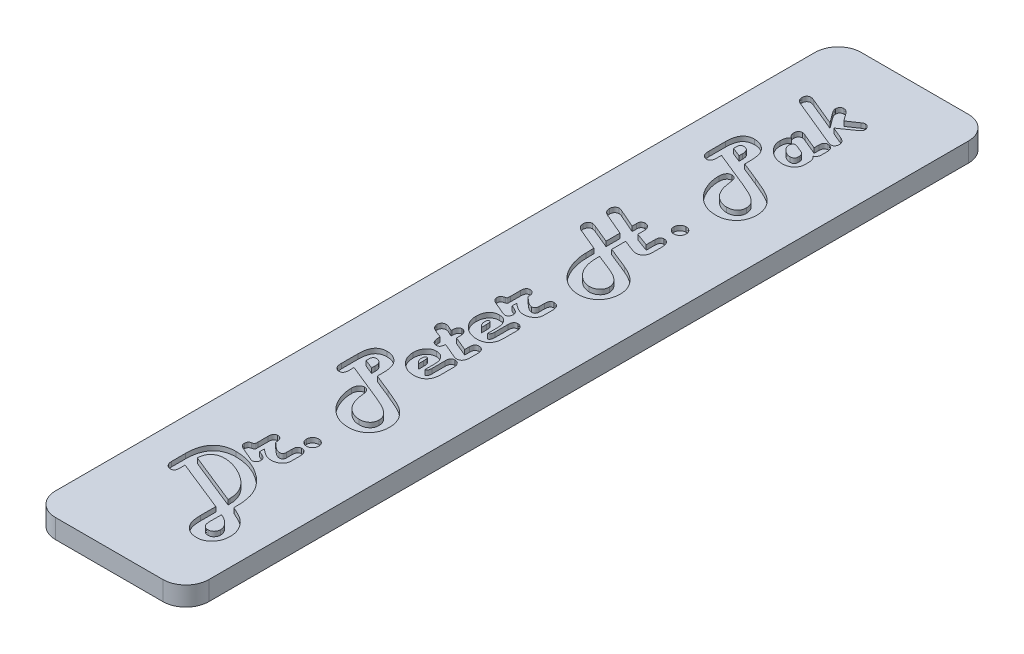
from build123d import *

# Parameters (mm, degrees)
BOSS_EXTRUDE1_DEPTH      = 66.675
BOSS_EXTRUDE1_DEPTH_BACK = 66.675
SKETCH3_W                = 25.4
SKETCH3_H                = 3.175
SKETCH5_OUTSIDE_W        = 54.556
SKETCH5_OUTSIDE_H        = 162.506
CUT_EXTRUDE2_DEPTH       = 68.947967225
CUT_EXTRUDE1_DEPTH       = 0.79375


with BuildPart() as part:
    # Sketch3 → Boss-Extrude1 (new, two sides: drawn at the far end of the back side and taken through both)
    with BuildSketch(Plane.XY.offset(-BOSS_EXTRUDE1_DEPTH_BACK)):
        Rectangle(SKETCH3_W, SKETCH3_H)
    extrude(amount=BOSS_EXTRUDE1_DEPTH + BOSS_EXTRUDE1_DEPTH_BACK)

    # Sketch5 outside → Cut-Extrude2 (cut, through all)
    with BuildSketch(Plane(origin=(0, 1.5875, 0), x_dir=(1, 0, 0), z_dir=(0, 1, 0))):
        Rectangle(SKETCH5_OUTSIDE_W, SKETCH5_OUTSIDE_H)
        with BuildLine():
            Line((12.7, -62.865), (12.7, 62.865))
            ThreePointArc((12.7, 62.865), (11.584076836, 65.559076836), (8.89, 66.675))
            Line((8.89, 66.675), (-8.89, 66.675))
            ThreePointArc((-8.89, 66.675), (-11.584076836, 65.559076836), (-12.7, 62.865))
            Line((-12.7, 62.865), (-12.7, -62.865))
            ThreePointArc((-12.7, -62.865), (-11.584076836, -65.559076836), (-8.89, -66.675))
            Line((-8.89, -66.675), (8.89, -66.675))
            ThreePointArc((8.89, -66.675), (11.584076836, -65.559076836), (12.7, -62.865))
        make_face(mode=Mode.SUBTRACT)
    extrude(amount=-CUT_EXTRUDE2_DEPTH, mode=Mode.SUBTRACT)

    # Sketch4 → Cut-Extrude1 (cut)
    # profile 1 of 13: a face of its own
    with BuildSketch(Plane(origin=(0, 1.5875, 0), x_dir=(1, 0, 0), z_dir=(0, 1, 0))):
        with BuildLine():
            Line((-5.679178082, -48.4375), (-5.679178082, -49.15239726))
            Line((-5.679178082, -49.15239726), (-5.679178082, -49.347174658))
            add(Edge.make_bspline(
                [(-5.679178082, -49.347174658), (-5.681139035, -49.414360632), (-5.684812377, -49.540216354), (-5.713924446, -49.716430739), (-5.764512562, -49.867188873), (-5.837559677, -49.99180106), (-5.932023683, -50.090670853), (-6.050370432, -50.157874621), (-6.187957449, -50.199706323), (-6.286731391, -50.203496084), (-6.338424658, -50.205479452)],
                knots=[0, 0, 0, 0, 1.305737749, 2.445965353, 3.459324035, 4.379959175, 5.233349143, 6.085046436, 6.997810513, 8, 8, 8, 8], degree=3))
            add(Edge.make_bspline(
                [(-6.338424658, -50.205479452), (-6.405985442, -50.201463445), (-6.539317941, -50.19353778), (-6.730590117, -50.127009766), (-6.900338749, -50.01327261), (-7.049639341, -49.863521792), (-7.170453869, -49.681850565), (-7.259374763, -49.476884403), (-7.314351235, -49.252284688), (-7.320079852, -49.095636531), (-7.323013699, -49.015410959)],
                knots=[0, 0, 0, 0, 0.941902933, 1.858863449, 2.78744378, 3.773831386, 4.79357467, 5.815409039, 6.881186575, 8, 8, 8, 8], degree=3))
            Line((-7.323013699, -49.015410959), (-7.323013699, -48.820633562))
            Line((-7.323013699, -48.820633562), (-7.323013699, -46.703767123))
            add(Edge.make_bspline(
                [(-7.323013699, -46.703767123), (-7.320475549, -46.529568132), (-7.3155453, -46.191193923), (-7.267820653, -45.699687944), (-7.18958523, -45.239346718), (-7.078704255, -44.810310283), (-6.936975313, -44.412014898), (-6.766991285, -44.042956191), (-6.559923115, -43.70788989), (-6.323501854, -43.403858302), (-6.057697159, -43.132915687), (-5.762245196, -42.897904873), (-5.438747353, -42.699594188), (-5.08679158, -42.539139662), (-4.708155717, -42.412163034), (-4.301971757, -42.323645561), (-3.868472678, -42.268766818), (-3.570331213, -42.263161285), (-3.416763699, -42.260273973)],
                knots=[0, 0, 0, 0, 1.240121913, 2.408884614, 3.512215636, 4.562072732, 5.559962685, 6.519078054, 7.449661058, 8.358196616, 9.256317547, 10.145746268, 11.039719344, 11.951275398, 12.894325228, 13.877939151, 14.906963136, 16, 16, 16, 16], degree=3))
            add(Edge.make_bspline(
                [(-3.416763699, -42.260273973), (-3.178865588, -42.265731432), (-2.706260316, -42.276573149), (-2.005222822, -42.372986503), (-1.318852245, -42.52372676), (-0.648003468, -42.737503562), (0.007875584, -43.009930566), (0.646543553, -43.346831935), (1.273595063, -43.739872208), (1.667793593, -44.046145266), (1.867910959, -44.201626712)],
                knots=[0, 0, 0, 0, 0.99369571, 1.974062893, 2.951324249, 3.9272385, 4.912259598, 5.915104549, 6.941589699, 8, 8, 8, 8], degree=3))
            add(Edge.make_bspline(
                [(1.867910959, -44.201626712), (1.978197285, -44.293094421), (2.196111311, -44.473824865), (2.499418667, -44.763842496), (2.779873067, -45.061315674), (3.039382379, -45.3666887), (3.273370418, -45.682786693), (3.486715378, -46.006612615), (3.675652207, -46.34007595), (3.843402214, -46.683703216), (3.989712633, -47.040335623), (4.113540628, -47.413401258), (4.220514455, -47.802650974), (4.308869798, -48.209784543), (4.373145314, -48.633958744), (4.424054428, -49.074296907), (4.450629208, -49.532349546), (4.455387373, -49.843721433), (4.457808219, -50.002140411)],
                knots=[0, 0, 0, 0, 1.041972891, 2.058827374, 3.050103684, 4.014970579, 4.971989252, 5.909071109, 6.834104011, 7.757898592, 8.688895906, 9.635856426, 10.615406742, 11.624176682, 12.664286734, 13.734882699, 14.847559518, 16, 16, 16, 16], degree=3))
            Line((4.457808219, -50.002140411), (4.457808219, -50.511558219))
            Line((4.457808219, -50.511558219), (4.663287671, -50.599315068))
            add(Edge.make_bspline(
                [(4.663287671, -50.599315068), (4.755305177, -50.640737259), (4.932339916, -50.720430428), (5.188267535, -50.8348362), (5.420463771, -50.947113972), (5.633030062, -51.049206997), (5.82373241, -51.145240291), (5.99217766, -51.235667816), (6.141385488, -51.315863411), (6.310069605, -51.419562509), (6.506008189, -51.553715434), (6.734132992, -51.7291217), (6.95674715, -51.928609077), (7.097822135, -52.074587313), (7.169708904, -52.148972603)],
                knots=[0, 0, 0, 0, 1.222800361, 2.352575644, 3.396669397, 4.347862466, 5.210067408, 5.983579217, 6.664594993, 7.262130753, 8.381971782, 9.540587582, 10.746771362, 12, 12, 12, 12], degree=3))
            add(Edge.make_bspline(
                [(7.169708904, -52.148972603), (7.259252012, -52.250238777), (7.435529099, -52.449594226), (7.665799852, -52.770159117), (7.858042816, -53.10295975), (8.019190077, -53.445056622), (8.140760579, -53.799995149), (8.228695229, -54.166112724), (8.284253944, -54.543103514), (8.290354057, -54.798611519), (8.293424658, -54.927226027)],
                knots=[0, 0, 0, 0, 1.055914228, 2.078702545, 3.078046045, 4.055880218, 5.029205391, 6.004237832, 6.995397536, 8, 8, 8, 8], degree=3))
            add(Edge.make_bspline(
                [(8.293424658, -54.927226027), (8.290620622, -55.032181608), (8.285111992, -55.238370658), (8.251873776, -55.540236082), (8.191027588, -55.827282758), (8.107560104, -56.100350042), (8.000632184, -56.360098977), (7.869465324, -56.605377374), (7.714553896, -56.835565306), (7.537138339, -57.048967819), (7.341577706, -57.242686189), (7.131886859, -57.412716184), (6.908215426, -57.555377102), (6.672939661, -57.674370709), (6.422108099, -57.763262195), (6.160276549, -57.830881289), (5.884472994, -57.869493566), (5.696509044, -57.874276567), (5.600787671, -57.876712329)],
                knots=[0, 0, 0, 0, 1.126201464, 2.212463691, 3.25287726, 4.269850786, 5.272053028, 6.261782411, 7.249022054, 8.243830034, 9.23438794, 10.19795826, 11.134388982, 12.075812372, 13.02018767, 13.98375799, 14.973220915, 16, 16, 16, 16], degree=3))
            add(Edge.make_bspline(
                [(5.600787671, -57.876712329), (5.481962949, -57.873170414), (5.246551589, -57.866153298), (4.901392086, -57.792403303), (4.565645333, -57.68478943), (4.247078567, -57.527761437), (3.950050697, -57.334590095), (3.685416052, -57.106263727), (3.453108861, -56.846615719), (3.329976245, -56.650781154), (3.267739726, -56.551797945)],
                knots=[0, 0, 0, 0, 1.014242392, 2.009381349, 3.004557683, 4.021967388, 5.035219112, 6.025505851, 7.00200576, 8, 8, 8, 8], degree=3))
            add(Edge.make_bspline(
                [(3.267739726, -56.551797945), (3.230782911, -56.483212265), (3.155401117, -56.343316236), (3.064407715, -56.117004749), (2.987950753, -55.874125177), (2.922935082, -55.614147231), (2.875444298, -55.336362882), (2.838346721, -55.041501483), (2.817034776, -54.729199498), (2.815010595, -54.514872037), (2.813972603, -54.404965753)],
                knots=[0, 0, 0, 0, 0.84245226, 1.718372183, 2.633912599, 3.596293803, 4.615457363, 5.681185209, 6.810920853, 8, 8, 8, 8], degree=3))
            Line((2.813972603, -54.404965753), (2.813972603, -51.840753425))
            Line((2.813972603, -51.840753425), (-5.679178082, -48.4375))
        make_face()
        with BuildLine():
            Line((2.813972603, -49.809503425), (2.813972603, -49.520547945))
            add(Edge.make_bspline(
                [(2.813972603, -49.520547945), (2.812229985, -49.427742754), (2.808779397, -49.243977635), (2.784155566, -48.97104647), (2.746792266, -48.703432189), (2.6903681, -48.442021083), (2.619740112, -48.18684972), (2.534172231, -47.936962092), (2.430309071, -47.69321101), (2.314188361, -47.45311899), (2.17712634, -47.221571755), (2.028104247, -46.994358811), (1.861775087, -46.773823958), (1.683460875, -46.556553137), (1.483489685, -46.349768126), (1.273647666, -46.143061001), (1.042967987, -45.946694015), (0.88166229, -45.821304641), (0.79984589, -45.757705479)],
                knots=[0, 0, 0, 0, 1.003752549, 1.98754731, 2.96218803, 3.924869515, 4.877913061, 5.824875223, 6.779479857, 7.742439712, 8.707376773, 9.687714611, 10.680189018, 11.694008127, 12.725763052, 13.790025714, 14.879071578, 16, 16, 16, 16], degree=3))
            add(Edge.make_bspline(
                [(0.79984589, -45.757705479), (0.637495563, -45.639521717), (0.31362577, -45.403759024), (-0.202532711, -45.097266007), (-0.736886345, -44.825616882), (-1.286214939, -44.597601356), (-1.833665188, -44.411904167), (-2.367354317, -44.27768128), (-2.880398896, -44.193608397), (-3.216699298, -44.183164996), (-3.380376712, -44.178082192)],
                knots=[0, 0, 0, 0, 1.061151743, 2.116872814, 3.169496409, 4.227969904, 5.258553914, 6.222792805, 7.135033211, 8, 8, 8, 8], degree=3))
            add(Edge.make_bspline(
                [(-3.380376712, -44.178082192), (-3.46678892, -44.179475485), (-3.635806387, -44.182200688), (-3.882804511, -44.210840925), (-4.115991615, -44.256554151), (-4.334080712, -44.324244376), (-4.538944612, -44.407360833), (-4.730305436, -44.510069827), (-4.906157833, -44.633051725), (-5.067898235, -44.772021882), (-5.2103847, -44.92929446), (-5.338824533, -45.098104457), (-5.442726671, -45.283456657), (-5.529114219, -45.480661143), (-5.598907159, -45.690938389), (-5.64329496, -45.916111969), (-5.675977303, -46.153445008), (-5.678092042, -46.316229545), (-5.679178082, -46.399828767)],
                knots=[0, 0, 0, 0, 1.145531499, 2.240595844, 3.292755274, 4.292422607, 5.264114043, 6.220902991, 7.165828125, 8.104908158, 9.042461542, 9.975419986, 10.911970153, 11.852526766, 12.827988561, 13.843075609, 14.892295267, 16, 16, 16, 16], degree=3))
            Line((-5.679178082, -46.399828767), (2.813972603, -49.809503425))
        make_face(mode=Mode.SUBTRACT)
        with BuildLine():
            Line((4.457808219, -52.540667808), (4.457808219, -54.456335616))
            add(Edge.make_bspline(
                [(4.457808219, -54.456335616), (4.460994809, -54.563553711), (4.466957488, -54.764177924), (4.512836115, -55.044935926), (4.591499209, -55.284716104), (4.709872635, -55.48035428), (4.858337145, -55.637193663), (5.044659494, -55.745721965), (5.262554621, -55.811499808), (5.418357057, -55.818330277), (5.500188356, -55.821917808)],
                knots=[0, 0, 0, 0, 1.31364871, 2.458071474, 3.475829816, 4.38621616, 5.23967168, 6.094559773, 6.99921559, 8, 8, 8, 8], degree=3))
            add(Edge.make_bspline(
                [(5.500188356, -55.821917808), (5.569155028, -55.818508344), (5.703961188, -55.811844013), (5.896015584, -55.75070694), (6.072433285, -55.655434717), (6.223360846, -55.519174371), (6.353187059, -55.360368774), (6.446221691, -55.17802116), (6.501322507, -54.978187106), (6.508778068, -54.839818254), (6.51260274, -54.768835616)],
                knots=[0, 0, 0, 0, 1.015443884, 1.984844108, 2.946375274, 3.953924431, 4.965428653, 5.959234333, 6.953095811, 8, 8, 8, 8], degree=3))
            add(Edge.make_bspline(
                [(6.51260274, -54.768835616), (6.510944819, -54.714517742), (6.507632271, -54.605989947), (6.481106386, -54.444447437), (6.436939997, -54.285250348), (6.380697586, -54.126273978), (6.301924225, -53.971486371), (6.206309798, -53.81962045), (6.098402384, -53.666315926), (5.922661518, -53.46837573), (5.670783127, -53.227852864), (5.316162311, -52.969273847), (4.909349592, -52.734260308), (4.611992169, -52.606772175), (4.457808219, -52.540667808)],
                knots=[0, 0, 0, 0, 0.609246736, 1.21728261, 1.830931323, 2.461525313, 3.105941494, 3.774613737, 4.474427454, 5.206422339, 6.740961797, 8.372497183, 10.119089455, 12, 12, 12, 12], degree=3))
        make_face(mode=Mode.SUBTRACT)
    # profile 2 of 13: a face of its own
    with BuildSketch(Plane(origin=(0, 1.5875, 0), x_dir=(1, 0, 0), z_dir=(0, 1, 0))):
        with BuildLine():
            Line((-1.43260274, -40.323202055), (-0.846130137, -40.577910959))
            add(Edge.make_bspline(
                [(-0.846130137, -40.577910959), (-0.784113415, -40.60662941), (-0.665976306, -40.66133586), (-0.507163435, -40.759059692), (-0.36948265, -40.859057454), (-0.257336482, -40.968303485), (-0.16943101, -41.084880946), (-0.108767407, -41.209272116), (-0.07035756, -41.339779101), (-0.065291412, -41.429535299), (-0.062739726, -41.474743151)],
                knots=[0, 0, 0, 0, 1.297501196, 2.471640463, 3.537215363, 4.524637192, 5.43567625, 6.296618738, 7.14205136, 8, 8, 8, 8], degree=3))
            add(Edge.make_bspline(
                [(-0.062739726, -41.474743151), (-0.064249291, -41.528511065), (-0.067186018, -41.633111852), (-0.105649348, -41.781807267), (-0.163102956, -41.918661882), (-0.246876118, -42.036109947), (-0.34425513, -42.136402549), (-0.457491489, -42.209046137), (-0.583595576, -42.251085914), (-0.671025425, -42.257173007), (-0.715565068, -42.260273973)],
                knots=[0, 0, 0, 0, 1.131994738, 2.202197021, 3.220602635, 4.248319073, 5.22801886, 6.155513921, 7.060358075, 8, 8, 8, 8], degree=3))
            add(Edge.make_bspline(
                [(-0.715565068, -42.260273973), (-0.747081309, -42.257482087), (-0.820370025, -42.250989761), (-0.942225513, -42.218386593), (-1.090708332, -42.165266182), (-1.198044875, -42.121614728), (-1.257089041, -42.09760274)],
                knots=[0, 0, 0, 0, 0.667539348, 1.552314029, 2.65356594, 4, 4, 4, 4], degree=3))
            Line((-1.257089041, -42.09760274), (-3.19630137, -41.264982877))
            add(Edge.make_bspline(
                [(-3.19630137, -41.264982877), (-3.251910738, -41.239871495), (-3.358097521, -41.191920999), (-3.500931864, -41.102277523), (-3.62350436, -41.007331997), (-3.724073706, -40.903072065), (-3.802724918, -40.791532894), (-3.856319972, -40.670557054), (-3.893260946, -40.542986431), (-3.896639037, -40.454034112), (-3.898356164, -40.408818493)],
                knots=[0, 0, 0, 0, 1.242093141, 2.371792344, 3.427691145, 4.394328043, 5.313892613, 6.192305435, 7.081125362, 8, 8, 8, 8], degree=3))
            add(Edge.make_bspline(
                [(-3.898356164, -40.408818493), (-3.896510838, -40.365214486), (-3.893007731, -40.282438049), (-3.872120133, -40.163717182), (-3.833957565, -40.058468125), (-3.779281238, -39.966442169), (-3.709475187, -39.887063335), (-3.622457216, -39.823748929), (-3.521903931, -39.77021904), (-3.447254499, -39.748231903), (-3.408202055, -39.736729452)],
                knots=[0, 0, 0, 0, 1.15314347, 2.189090296, 3.173792814, 4.095790583, 5.004376053, 5.947550008, 6.926271946, 8, 8, 8, 8], degree=3))
            Line((-3.408202055, -39.736729452), (-3.192020548, -39.676797945))
            add(Edge.make_bspline(
                [(-3.192020548, -39.676797945), (-3.166012398, -39.669863193), (-3.118375193, -39.65716132), (-3.056598309, -39.626686288), (-3.010020126, -39.590990924), (-2.976955035, -39.542830972), (-2.959433608, -39.475135682), (-2.948144639, -39.381098298), (-2.939675458, -39.255975063), (-2.939531558, -39.161683739), (-2.939452055, -39.109589041)],
                knots=[0, 0, 0, 0, 0.926850573, 1.697643703, 2.362895762, 2.92973869, 3.677374781, 4.746381598, 6.202419277, 8, 8, 8, 8], degree=3))
            Line((-2.939452055, -39.109589041), (-2.939452055, -37.418664384))
            add(Edge.make_bspline(
                [(-2.939452055, -37.418664384), (-2.937570141, -37.34719095), (-2.934050522, -37.213518924), (-2.904069677, -37.026405118), (-2.856572636, -36.866818621), (-2.788575116, -36.733591282), (-2.695673752, -36.63157237), (-2.582883881, -36.558829169), (-2.450261525, -36.514738499), (-2.35546974, -36.509558586), (-2.305890411, -36.506849315)],
                knots=[0, 0, 0, 0, 1.361355543, 2.546053047, 3.599677592, 4.524244374, 5.371169927, 6.197098625, 7.057021238, 8, 8, 8, 8], degree=3))
            add(Edge.make_bspline(
                [(-2.305890411, -36.506849315), (-2.236908431, -36.509278356), (-2.105643936, -36.513900532), (-1.923598266, -36.572058432), (-1.766736412, -36.663047491), (-1.643256267, -36.797417352), (-1.544572999, -36.964727078), (-1.478735842, -37.16919144), (-1.43796965, -37.408470619), (-1.434471998, -37.579714558), (-1.43260274, -37.671232877)],
                knots=[0, 0, 0, 0, 0.994284648, 1.892005291, 2.734571892, 3.588753721, 4.500369607, 5.525254763, 6.677415825, 8, 8, 8, 8], degree=3))
            Line((-1.43260274, -37.671232877), (-1.361969178, -37.74614726))
            add(Edge.make_bspline(
                [(-1.361969178, -37.74614726), (-1.275640685, -37.831791583), (-1.110395067, -37.995727595), (-0.863701621, -38.217743009), (-0.631112245, -38.405135482), (-0.416532555, -38.561284871), (-0.213839595, -38.680200683), (-0.028186714, -38.767002538), (0.143696282, -38.824159674), (0.25510596, -38.83194945), (0.30755137, -38.835616438)],
                knots=[0, 0, 0, 0, 1.435762249, 2.748263184, 3.91660617, 4.961556361, 5.879059361, 6.685751502, 7.381325737, 8, 8, 8, 8], degree=3))
            add(Edge.make_bspline(
                [(0.30755137, -38.835616438), (0.353486324, -38.834708621), (0.440770679, -38.832983612), (0.561359469, -38.800373242), (0.668100093, -38.75855924), (0.75127153, -38.688155952), (0.818376722, -38.601962545), (0.864001338, -38.49591952), (0.892910502, -38.371960638), (0.89503041, -38.283578433), (0.896164384, -38.23630137)],
                knots=[0, 0, 0, 0, 1.140484469, 2.167117703, 3.098941929, 3.971150526, 4.846255631, 5.80154673, 6.824011975, 8, 8, 8, 8], degree=3))
            Line((0.896164384, -38.23630137), (0.896164384, -37.324486301))
            add(Edge.make_bspline(
                [(0.896164384, -37.324486301), (0.898182521, -37.249489796), (0.901949312, -37.109511114), (0.930142152, -36.912986702), (0.983520387, -36.746801303), (1.055151224, -36.608297685), (1.150718895, -36.500587561), (1.267698419, -36.423361282), (1.407306267, -36.377188321), (1.50724529, -36.372384163), (1.559691781, -36.369863014)],
                knots=[0, 0, 0, 0, 1.364190584, 2.546219988, 3.596843527, 4.525897283, 5.362221888, 6.186477391, 7.048290713, 8, 8, 8, 8], degree=3))
            add(Edge.make_bspline(
                [(1.559691781, -36.369863014), (1.633666212, -36.373737748), (1.775914151, -36.381188604), (1.975742682, -36.444875462), (2.149287601, -36.550608035), (2.291023797, -36.700497696), (2.40652937, -36.88473357), (2.482997056, -37.105763246), (2.533984606, -37.356399757), (2.537926761, -37.534669789), (2.54, -37.628424658)],
                knots=[0, 0, 0, 0, 0.982615473, 1.889504555, 2.759142238, 3.658944971, 4.610088785, 5.631441668, 6.75433984, 8, 8, 8, 8], degree=3))
            Line((2.54, -37.628424658), (2.54, -39.045376712))
            add(Edge.make_bspline(
                [(2.54, -39.045376712), (2.5383024, -39.101834), (2.534977996, -39.212394088), (2.510384601, -39.374339837), (2.472968238, -39.529149648), (2.416521678, -39.67534175), (2.344926398, -39.813461247), (2.259558563, -39.945170648), (2.155710436, -40.066988663), (2.038215237, -40.180403687), (1.907947493, -40.282208342), (1.768882381, -40.372988903), (1.61926785, -40.44812051), (1.461132501, -40.51047307), (1.292391004, -40.557354481), (1.114822727, -40.590970741), (0.928132827, -40.613534175), (0.800627218, -40.615457815), (0.735633562, -40.616438356)],
                knots=[0, 0, 0, 0, 1.009407673, 1.976719137, 2.923785669, 3.852797958, 4.771676065, 5.702527031, 6.65345443, 7.628144937, 8.618662201, 9.606215811, 10.593522047, 11.607757909, 12.641947342, 13.720607507, 14.838121302, 16, 16, 16, 16], degree=3))
            add(Edge.make_bspline(
                [(0.735633562, -40.616438356), (0.651262954, -40.613402703), (0.482172253, -40.607318821), (0.230972093, -40.562642344), (-0.017070175, -40.492341768), (-0.265153047, -40.388075544), (-0.523447633, -40.245782051), (-0.803548993, -40.06202963), (-1.111236787, -39.834290816), (-1.32133514, -39.662760085), (-1.43260274, -39.571917808)],
                knots=[0, 0, 0, 0, 0.822710096, 1.64882809, 2.481516469, 3.333299355, 4.267584386, 5.354441073, 6.598918144, 8, 8, 8, 8], degree=3))
            Line((-1.43260274, -39.571917808), (-1.43260274, -40.323202055))
        make_face()
    # profile 3 of 13: a face of its own
    with BuildSketch(Plane(origin=(0, 1.5875, 0), x_dir=(1, 0, 0), z_dir=(0, 1, 0))):
        with BuildLine():
            add(Edge.make_bspline(
                [(0.622191781, -34.653253425), (0.625798096, -34.585054893), (0.632835998, -34.451962065), (0.691439504, -34.260145137), (0.787228625, -34.083717763), (0.920147512, -33.928092717), (1.075772557, -33.79517383), (1.252199931, -33.699384709), (1.44401686, -33.640781204), (1.577109688, -33.633743301), (1.645308219, -33.630136986)],
                knots=[0, 0, 0, 0, 1.018015329, 1.986707578, 2.970091954, 4, 5.029908046, 6.013292422, 6.981984671, 8, 8, 8, 8], degree=3))
            add(Edge.make_bspline(
                [(1.645308219, -33.630136986), (1.714197217, -33.633823875), (1.849331034, -33.641056138), (2.044134079, -33.698941688), (2.223061144, -33.794550327), (2.378993595, -33.928150896), (2.511958868, -34.083702955), (2.607736163, -34.260148937), (2.66634272, -34.451961065), (2.673380202, -34.585054554), (2.676986301, -34.653253425)],
                knots=[0, 0, 0, 0, 1.023458974, 2.007634331, 2.995409192, 4.02013336, 5.044857529, 6.023292197, 6.987108688, 8, 8, 8, 8], degree=3))
            add(Edge.make_bspline(
                [(2.676986301, -34.653253425), (2.673299631, -34.722142767), (2.666067797, -34.85727726), (2.608179119, -35.05207538), (2.512582459, -35.2310213), (2.378935452, -35.386880657), (2.223076095, -35.520527665), (2.044130175, -35.616124325), (1.849332054, -35.674013003), (1.714197562, -35.681244837), (1.645308219, -35.684931507)],
                knots=[0, 0, 0, 0, 1.018333356, 1.997579833, 2.980407786, 4, 5.019592214, 6.002420167, 6.981666644, 8, 8, 8, 8], degree=3))
            add(Edge.make_bspline(
                [(1.645308219, -35.684931507), (1.577109349, -35.681325408), (1.44401586, -35.674287925), (1.252203731, -35.615681369), (1.07575775, -35.519904074), (0.92020569, -35.3869388), (0.786605121, -35.23100635), (0.690996483, -35.052079284), (0.633110933, -34.85727624), (0.62587867, -34.722142423), (0.622191781, -34.653253425)],
                knots=[0, 0, 0, 0, 1.012891312, 1.976707803, 2.955142471, 3.97986664, 5.004590808, 5.992365669, 6.976541026, 8, 8, 8, 8], degree=3))
        make_face()
    # profile 4 of 13: a face of its own
    with BuildSketch(Plane(origin=(0, 1.5875, 0), x_dir=(1, 0, 0), z_dir=(0, 1, 0))):
        with BuildLine():
            Line((-2.528493151, -19.768835616), (0.468082192, -20.971746575))
            add(Edge.make_bspline(
                [(0.468082192, -20.971746575), (0.646605168, -21.044143119), (0.98930413, -21.183118063), (1.479984957, -21.389111007), (1.927524873, -21.581370126), (2.332073965, -21.761206074), (2.694678773, -21.92716251), (3.012300763, -22.08337819), (3.287632894, -22.224299144), (3.595464196, -22.393917333), (3.938220221, -22.614975918), (4.31394281, -22.908946636), (4.659889364, -23.234965114), (4.863180158, -23.476802671), (4.965085616, -23.598030822)],
                knots=[0, 0, 0, 0, 1.316025526, 2.52628873, 3.635396764, 4.643473973, 5.550686247, 6.359394249, 7.061322966, 7.663498093, 8.7599393, 9.843181906, 10.918831827, 12, 12, 12, 12], degree=3))
            add(Edge.make_bspline(
                [(4.965085616, -23.598030822), (5.033663279, -23.68973647), (5.169396928, -23.871246627), (5.345521293, -24.160577415), (5.496028705, -24.459214156), (5.616316993, -24.770731186), (5.710422447, -25.092293519), (5.779130711, -25.425006426), (5.820954267, -25.76875914), (5.825414086, -26.001594985), (5.827671233, -26.119434932)],
                knots=[0, 0, 0, 0, 1.011044617, 2.001129376, 2.987597007, 3.961339675, 4.946518016, 5.943976879, 6.959431467, 8, 8, 8, 8], degree=3))
            add(Edge.make_bspline(
                [(5.827671233, -26.119434932), (5.825021245, -26.243027473), (5.81984069, -26.484642937), (5.772659738, -26.837492526), (5.702056665, -27.173783407), (5.595312945, -27.491336202), (5.463552066, -27.792870536), (5.29897733, -28.075112515), (5.105962918, -28.339707164), (4.883147102, -28.582559515), (4.638452641, -28.80268534), (4.37311079, -28.993927926), (4.091430482, -29.158474286), (3.790314781, -29.290915042), (3.471895655, -29.394266352), (3.136118995, -29.465735921), (2.783187232, -29.512664019), (2.541583246, -29.517879892), (2.417996575, -29.520547945)],
                knots=[0, 0, 0, 0, 1.095039877, 2.140732475, 3.150521304, 4.13652018, 5.104897175, 6.062745876, 7.026672252, 8.00261995, 8.979018386, 9.939223627, 10.897072327, 11.865449322, 12.849478696, 13.859267525, 14.904960123, 16, 16, 16, 16], degree=3))
            add(Edge.make_bspline(
                [(2.417996575, -29.520547945), (2.251518318, -29.515981835), (1.922840707, -29.506966974), (1.438042785, -29.436460081), (0.969361737, -29.321643329), (0.517140375, -29.156194013), (0.079028027, -28.949727904), (-0.340430111, -28.691404421), (-0.745102437, -28.389480748), (-0.995150141, -28.157363147), (-1.122243151, -28.039383562)],
                knots=[0, 0, 0, 0, 1.013796752, 2.00153641, 2.977647105, 3.948285219, 4.930040032, 5.922901228, 6.94426252, 8, 8, 8, 8], degree=3))
            add(Edge.make_bspline(
                [(-1.122243151, -28.039383562), (-1.189454403, -27.971690882), (-1.325116403, -27.835057152), (-1.513764646, -27.614384454), (-1.694783307, -27.382971193), (-1.863649938, -27.137797757), (-2.023861106, -26.881553758), (-2.175096482, -26.612864031), (-2.312491032, -26.330178019), (-2.486429726, -25.942777006), (-2.666076845, -25.448098023), (-2.823942239, -24.849486603), (-2.919593957, -24.251790503), (-2.932855769, -23.85378546), (-2.939452055, -23.655821918)],
                knots=[0, 0, 0, 0, 0.706169296, 1.425361597, 2.148231665, 2.881015689, 3.628657503, 4.385575625, 5.162942875, 5.955265483, 7.529696308, 9.053365446, 10.534374814, 12, 12, 12, 12], degree=3))
            add(Edge.make_bspline(
                [(-2.939452055, -23.655821918), (-2.937379434, -23.565614541), (-2.933412841, -23.392975227), (-2.881469747, -23.149269089), (-2.806969238, -22.930099338), (-2.694392997, -22.743641808), (-2.558393536, -22.588785307), (-2.396459417, -22.47621601), (-2.212473912, -22.40862793), (-2.083136755, -22.401108916), (-2.016934932, -22.397260274)],
                knots=[0, 0, 0, 0, 1.238099196, 2.369480208, 3.412225081, 4.406632522, 5.344448297, 6.226188743, 7.092066479, 8, 8, 8, 8], degree=3))
            add(Edge.make_bspline(
                [(-2.016934932, -22.397260274), (-1.947119022, -22.401652077), (-1.811008177, -22.410214195), (-1.617625719, -22.482039242), (-1.447947552, -22.603525683), (-1.360234313, -22.71305638), (-1.314880137, -22.769691781)],
                knots=[0, 0, 0, 0, 1.010937669, 1.970891475, 2.950802117, 4, 4, 4, 4], degree=3))
            add(Edge.make_bspline(
                [(-1.314880137, -22.769691781), (-1.288929746, -22.813145676), (-1.230484324, -22.911012456), (-1.175166874, -23.096728204), (-1.128726034, -23.328028032), (-1.110675194, -23.500025948), (-1.100839041, -23.59375)],
                knots=[0, 0, 0, 0, 0.704559972, 1.586808607, 2.68501851, 4, 4, 4, 4], degree=3))
            add(Edge.make_bspline(
                [(-1.100839041, -23.59375), (-1.089183296, -23.709485301), (-1.06645289, -23.935186057), (-1.013198311, -24.26401388), (-0.953396538, -24.57693045), (-0.875308109, -24.872213688), (-0.787244725, -25.151398004), (-0.690826584, -25.415197285), (-0.576231042, -25.660315455), (-0.490288613, -25.814545499), (-0.448013699, -25.890410959)],
                knots=[0, 0, 0, 0, 1.159710426, 2.261604866, 3.320677166, 4.335395728, 5.305245955, 6.239579045, 7.134052342, 8, 8, 8, 8], degree=3))
            add(Edge.make_bspline(
                [(-0.448013699, -25.890410959), (-0.372472899, -26.008144883), (-0.223661455, -26.240074588), (0.04912054, -26.548366639), (0.352116735, -26.820452206), (0.686799447, -27.050418831), (1.043062954, -27.234102076), (1.412253838, -27.368865339), (1.792189257, -27.451456594), (2.049445293, -27.460982945), (2.178270548, -27.465753425)],
                knots=[0, 0, 0, 0, 1.047576128, 2.063670475, 3.075290511, 4.094745252, 5.099666308, 6.072755065, 7.034899922, 8, 8, 8, 8], degree=3))
            add(Edge.make_bspline(
                [(2.178270548, -27.465753425), (2.242537202, -27.464585065), (2.368515303, -27.462294798), (2.552365658, -27.442500988), (2.726836326, -27.411673793), (2.889551067, -27.363467215), (3.043074989, -27.305708349), (3.187583666, -27.235780247), (3.319581565, -27.14894128), (3.443202469, -27.053393542), (3.551242103, -26.943265933), (3.649004844, -26.826624613), (3.727875897, -26.698010852), (3.795682208, -26.562561774), (3.846319999, -26.417042606), (3.882408949, -26.262768225), (3.907540976, -26.100277825), (3.909078336, -25.988255584), (3.909863014, -25.931078767)],
                knots=[0, 0, 0, 0, 1.180906515, 2.314860832, 3.395146952, 4.432720844, 5.428859457, 6.408284318, 7.375873327, 8.328235049, 9.274073667, 10.205991361, 11.119268818, 12.040047653, 12.985704432, 13.943108951, 14.9501506, 16, 16, 16, 16], degree=3))
            add(Edge.make_bspline(
                [(3.909863014, -25.931078767), (3.90827078, -25.858125781), (3.905127769, -25.71411925), (3.866170118, -25.503354824), (3.808908804, -25.299851722), (3.726487079, -25.103939486), (3.621323279, -24.914941706), (3.491837905, -24.734215864), (3.338035606, -24.562456909), (3.160026305, -24.395161393), (2.950112727, -24.232423208), (2.710540998, -24.06165015), (2.43108507, -23.893052084), (2.117671326, -23.71616036), (1.766738772, -23.538458527), (1.380919342, -23.352833664), (0.956785812, -23.168772879), (0.661580923, -23.045442173), (0.50875, -22.981592466)],
                knots=[0, 0, 0, 0, 0.731676688, 1.444303058, 2.145016375, 2.851566032, 3.573211535, 4.312808279, 5.079163071, 5.88508809, 6.762346765, 7.744328667, 8.837972341, 10.037711651, 11.357883797, 12.787164715, 14.33667869, 16, 16, 16, 16], degree=3))
            Line((0.50875, -22.981592466), (-5.679178082, -20.46875))
            Line((-5.679178082, -20.46875), (-5.679178082, -21.256421233))
            add(Edge.make_bspline(
                [(-5.679178082, -21.256421233), (-5.6811333, -21.335007914), (-5.684793593, -21.482127174), (-5.713850113, -21.687983725), (-5.763464082, -21.863663508), (-5.836234887, -22.008371371), (-5.930582635, -22.122666689), (-6.047759143, -22.204657954), (-6.187151858, -22.253179311), (-6.286662642, -22.257846345), (-6.338424658, -22.260273973)],
                knots=[0, 0, 0, 0, 1.386647813, 2.595892835, 3.659749566, 4.594681301, 5.434731623, 6.248703716, 7.089037154, 8, 8, 8, 8], degree=3))
            add(Edge.make_bspline(
                [(-6.338424658, -22.260273973), (-6.41249416, -22.256775275), (-6.555373092, -22.250026341), (-6.755997736, -22.180390307), (-6.9307318, -22.068192122), (-7.076066539, -21.91048835), (-7.186412346, -21.710781245), (-7.267857335, -21.47720131), (-7.313402252, -21.207495514), (-7.319689931, -21.016865802), (-7.323013699, -20.91609589)],
                knots=[0, 0, 0, 0, 0.942409434, 1.817893302, 2.674221847, 3.569887169, 4.524363572, 5.567001171, 6.713877944, 8, 8, 8, 8], degree=3))
            Line((-7.323013699, -20.91609589), (-7.323013699, -18.165667808))
            add(Edge.make_bspline(
                [(-7.323013699, -18.165667808), (-7.32135449, -18.052174477), (-7.318136688, -17.832070054), (-7.293905304, -17.513503109), (-7.258037256, -17.216825417), (-7.198353732, -16.945089106), (-7.130043821, -16.694845992), (-7.041032603, -16.468955918), (-6.939566643, -16.263874441), (-6.818400393, -16.082187633), (-6.681374616, -15.92292003), (-6.52658404, -15.785389301), (-6.3539945, -15.669971066), (-6.165637707, -15.572902761), (-5.958895294, -15.499635387), (-5.735292697, -15.449840312), (-5.494671136, -15.416423441), (-5.328270297, -15.412817053), (-5.242534247, -15.410958904)],
                knots=[0, 0, 0, 0, 1.377779469, 2.672010327, 3.877566876, 5.002296731, 6.047021908, 7.023471041, 7.945492411, 8.820022801, 9.667536142, 10.489793169, 11.325896471, 12.182086672, 13.056145004, 13.980726477, 14.959593374, 16, 16, 16, 16], degree=3))
            add(Edge.make_bspline(
                [(-5.242534247, -15.410958904), (-5.136782794, -15.414519623), (-4.929211295, -15.421508689), (-4.624959246, -15.468540382), (-4.336433965, -15.550765958), (-4.061842259, -15.664245926), (-3.8044282, -15.81391657), (-3.56003657, -15.993439502), (-3.329707685, -16.20501624), (-3.194472954, -16.36818243), (-3.125667808, -16.45119863)],
                knots=[0, 0, 0, 0, 1.037190231, 2.03582197, 3.010506387, 3.973515094, 4.942177049, 5.923321209, 6.943420921, 8, 8, 8, 8], degree=3))
            add(Edge.make_bspline(
                [(-3.125667808, -16.45119863), (-3.077697191, -16.517238864), (-2.97920855, -16.652826296), (-2.858370136, -16.882044549), (-2.755424247, -17.135926512), (-2.673160955, -17.415897451), (-2.606848864, -17.719815635), (-2.560454747, -18.049607252), (-2.532528553, -18.404902872), (-2.529867979, -18.650773687), (-2.528493151, -18.777825342)],
                knots=[0, 0, 0, 0, 0.800437442, 1.643380872, 2.535600309, 3.486195869, 4.50417187, 5.586788071, 6.752993229, 8, 8, 8, 8], degree=3))
            Line((-2.528493151, -18.777825342), (-2.528493151, -19.768835616))
        make_face()
        with BuildLine():
            Line((-4.172328767, -19.066780822), (-4.172328767, -18.48244863))
            add(Edge.make_bspline(
                [(-4.172328767, -18.48244863), (-4.174877342, -18.392354724), (-4.179687558, -18.222310207), (-4.22342482, -17.984961674), (-4.298224267, -17.782458661), (-4.403971303, -17.615065974), (-4.543228063, -17.483247088), (-4.715494994, -17.394014899), (-4.91489417, -17.335698461), (-5.058002969, -17.331158277), (-5.133373288, -17.328767123)],
                knots=[0, 0, 0, 0, 1.258971058, 2.376199826, 3.358208907, 4.260347007, 5.121448143, 6.005251248, 6.949436718, 8, 8, 8, 8], degree=3))
            add(Edge.make_bspline(
                [(-5.133373288, -17.328767123), (-5.176329115, -17.330820807), (-5.257705803, -17.334711362), (-5.371940821, -17.363614723), (-5.467070511, -17.417537291), (-5.547836666, -17.489832133), (-5.606457457, -17.586489953), (-5.650070226, -17.700945081), (-5.675062248, -17.835704718), (-5.677746857, -17.932258096), (-5.679178082, -17.983732877)],
                knots=[0, 0, 0, 0, 1.057975811, 2.004258143, 2.869579862, 3.727735231, 4.644179764, 5.623179532, 6.73286349, 8, 8, 8, 8], degree=3))
            Line((-5.679178082, -17.983732877), (-5.679178082, -18.467465753))
            Line((-5.679178082, -18.467465753), (-4.172328767, -19.066780822))
        make_face(mode=Mode.SUBTRACT)
    # profile 5 of 13: a face of its own
    with BuildSketch(Plane(origin=(0, 1.5875, 0), x_dir=(1, 0, 0), z_dir=(0, 1, 0))):
        with BuildLine():
            add(Edge.make_bspline(
                [(0.485205479, -14.916523973), (0.517756621, -14.914289769), (0.581105968, -14.909941677), (0.66882459, -14.868405605), (0.741661321, -14.800888706), (0.798876586, -14.707994106), (0.843990289, -14.591292705), (0.874049625, -14.449759167), (0.893306161, -14.282777052), (0.89516532, -14.163163946), (0.896164384, -14.098886986)],
                knots=[0, 0, 0, 0, 0.764367135, 1.48757176, 2.238468815, 3.079136104, 4.038989023, 5.178564659, 6.483834326, 8, 8, 8, 8], degree=3))
            Line((0.896164384, -14.098886986), (0.896164384, -11.954195205))
            add(Edge.make_bspline(
                [(0.896164384, -11.954195205), (0.897845932, -11.88196702), (0.901011907, -11.745977745), (0.933836463, -11.556264147), (0.982265841, -11.392332751), (1.058305916, -11.258780108), (1.155156215, -11.153505595), (1.273984409, -11.079068728), (1.414737085, -11.034988517), (1.515119833, -11.030024673), (1.568253425, -11.02739726)],
                knots=[0, 0, 0, 0, 1.330378268, 2.504800222, 3.540784378, 4.466013521, 5.313015675, 6.152526175, 7.022113639, 8, 8, 8, 8], degree=3))
            add(Edge.make_bspline(
                [(1.568253425, -11.02739726), (1.64083197, -11.030392339), (1.781090853, -11.036180365), (1.97744335, -11.100690292), (2.149429434, -11.204237606), (2.291101807, -11.351415697), (2.405391827, -11.532612923), (2.483928318, -11.749343108), (2.533665817, -11.99615817), (2.537821652, -12.172252241), (2.54, -12.264554795)],
                knots=[0, 0, 0, 0, 0.976459769, 1.88701984, 2.755728993, 3.661387505, 4.617841531, 5.626579212, 6.755933135, 8, 8, 8, 8], degree=3))
            Line((2.54, -12.264554795), (2.54, -14.30864726))
            add(Edge.make_bspline(
                [(2.54, -14.30864726), (2.538498971, -14.401466569), (2.53559464, -14.581061983), (2.509171856, -14.842139096), (2.467638756, -15.085750898), (2.406991582, -15.312672328), (2.331071401, -15.523635742), (2.234367496, -15.716179229), (2.121707372, -15.891902794), (1.993935794, -16.051372699), (1.846468801, -16.190527035), (1.68632924, -16.314066971), (1.50762556, -16.414971992), (1.313832731, -16.498616606), (1.104412336, -16.564569441), (0.879361474, -16.611664154), (0.63861038, -16.639780072), (0.472441412, -16.642455747), (0.386746575, -16.643835616)],
                knots=[0, 0, 0, 0, 1.227434829, 2.374954843, 3.467242871, 4.492791281, 5.478078509, 6.427692534, 7.336082474, 8.235159391, 9.122921699, 10.011937165, 10.903903105, 11.829580614, 12.799608803, 13.802811811, 14.866890212, 16, 16, 16, 16], degree=3))
            add(Edge.make_bspline(
                [(0.386746575, -16.643835616), (0.27529072, -16.641054857), (0.055729393, -16.635576927), (-0.267626242, -16.589177049), (-0.578471097, -16.514137417), (-0.879544621, -16.411100459), (-1.167326721, -16.275883489), (-1.444743769, -16.111967217), (-1.707437797, -15.915382155), (-1.958138807, -15.695093302), (-2.187995288, -15.453920093), (-2.386869774, -15.19592842), (-2.558330015, -14.928886998), (-2.698722771, -14.649506468), (-2.805102894, -14.357426426), (-2.882747934, -14.055012627), (-2.931632929, -13.741605771), (-2.936825326, -13.528289248), (-2.939452055, -13.420376712)],
                knots=[0, 0, 0, 0, 1.040413245, 2.049551489, 3.043375534, 4.023141954, 5.015714557, 6.007526584, 7.026927923, 8.074887039, 9.121150428, 10.132661257, 11.112246432, 12.080619832, 13.046032014, 14.009142413, 14.992865218, 16, 16, 16, 16], degree=3))
            add(Edge.make_bspline(
                [(-2.939452055, -13.420376712), (-2.937442252, -13.342578167), (-2.93350729, -13.190257619), (-2.913500509, -12.967378216), (-2.87365921, -12.757453821), (-2.823588014, -12.558359136), (-2.754315656, -12.371641027), (-2.67077078, -12.19644797), (-2.574876712, -12.0314354), (-2.460203657, -11.882279399), (-2.335762022, -11.74580888), (-2.199287464, -11.626717235), (-2.053853946, -11.525531412), (-1.898107029, -11.444207966), (-1.734296616, -11.378416116), (-1.55926394, -11.334671808), (-1.375083247, -11.305445672), (-1.248645155, -11.302744291), (-1.184315068, -11.301369863)],
                knots=[0, 0, 0, 0, 1.20765167, 2.364442186, 3.467641136, 4.520347312, 5.546697016, 6.552049339, 7.529957554, 8.502082256, 9.465848252, 10.391794486, 11.307021153, 12.208414204, 13.113065312, 14.039540961, 15.002543477, 16, 16, 16, 16], degree=3))
            add(Edge.make_bspline(
                [(-1.184315068, -11.301369863), (-1.107819997, -11.303761159), (-0.958096616, -11.30844163), (-0.741213008, -11.347135695), (-0.540220667, -11.412409059), (-0.353170282, -11.499265403), (-0.184652246, -11.618190208), (-0.030384031, -11.759529438), (0.10960169, -11.926774425), (0.185136878, -12.053618568), (0.224075342, -12.119006849)],
                knots=[0, 0, 0, 0, 1.069075517, 2.092495602, 3.067309766, 4.01772645, 4.964103366, 5.938458037, 6.93727308, 8, 8, 8, 8], degree=3))
            add(Edge.make_bspline(
                [(0.224075342, -12.119006849), (0.245815438, -12.1584762), (0.290796308, -12.240139397), (0.33971322, -12.376614625), (0.385182547, -12.525041981), (0.424024217, -12.687068272), (0.451113845, -12.863950461), (0.469332866, -13.05408162), (0.483154329, -13.258221693), (0.484506156, -13.398946944), (0.485205479, -13.471746575)],
                knots=[0, 0, 0, 0, 0.775695059, 1.604934926, 2.492087677, 3.452766344, 4.473981776, 5.574285297, 6.74513539, 8, 8, 8, 8], degree=3))
            Line((0.485205479, -13.471746575), (0.485205479, -14.916523973))
        make_face()
        with BuildLine():
            Line((-0.884657534, -14.569777397), (-0.884657534, -13.773544521))
            add(Edge.make_bspline(
                [(-0.884657534, -13.773544521), (-0.885670373, -13.707195177), (-0.887555968, -13.583672983), (-0.896204511, -13.411077521), (-0.917855063, -13.266771879), (-0.943812843, -13.148149274), (-0.980392519, -13.057448383), (-1.020588456, -12.987879636), (-1.079199118, -12.948599278), (-1.121074096, -12.946318418), (-1.141506849, -12.945205479)],
                knots=[0, 0, 0, 0, 1.703756022, 3.171872855, 4.430737384, 5.448043455, 6.277929624, 6.938312386, 7.48195314, 8, 8, 8, 8], degree=3))
            add(Edge.make_bspline(
                [(-1.141506849, -12.945205479), (-1.164680225, -12.948192716), (-1.209182799, -12.953929459), (-1.270664555, -12.984204424), (-1.321852732, -13.029563664), (-1.363341756, -13.09006205), (-1.395800383, -13.163971345), (-1.415025871, -13.253437217), (-1.431455001, -13.35628894), (-1.43220441, -13.430278699), (-1.43260274, -13.469606164)],
                knots=[0, 0, 0, 0, 0.839283018, 1.611774451, 2.433858042, 3.284934843, 4.2429058, 5.330802008, 6.5812524, 8, 8, 8, 8], degree=3))
            add(Edge.make_bspline(
                [(-1.43260274, -13.469606164), (-1.431043071, -13.526076944), (-1.427985788, -13.636771652), (-1.40145814, -13.798312468), (-1.359424558, -13.951005675), (-1.297730616, -14.094165505), (-1.222213662, -14.229309193), (-1.124704301, -14.352372359), (-1.014611987, -14.469290422), (-0.92844664, -14.535917574), (-0.884657534, -14.569777397)],
                knots=[0, 0, 0, 0, 1.059074119, 2.076009944, 3.063613489, 4.023510937, 4.995010178, 5.959100355, 6.962817714, 8, 8, 8, 8], degree=3))
        make_face(mode=Mode.SUBTRACT)
    # profile 6 of 13: a face of its own
    with BuildSketch(Plane(origin=(0, 1.5875, 0), x_dir=(1, 0, 0), z_dir=(0, 1, 0))):
        with BuildLine():
            Line((-2.939452055, -7.146832192), (-2.939452055, -6.924229452))
            add(Edge.make_bspline(
                [(-2.939452055, -6.924229452), (-2.938597618, -6.848434248), (-2.937001552, -6.70685085), (-2.905261991, -6.509827132), (-2.862197077, -6.340400935), (-2.791559903, -6.202576601), (-2.706465145, -6.090831903), (-2.596146667, -6.012605537), (-2.466312089, -5.96662976), (-2.373336577, -5.961541161), (-2.32515411, -5.95890411)],
                knots=[0, 0, 0, 0, 1.404766941, 2.624066756, 3.697329339, 4.633101669, 5.481073342, 6.278523074, 7.107883314, 8, 8, 8, 8], degree=3))
            add(Edge.make_bspline(
                [(-2.32515411, -5.95890411), (-2.25828012, -5.962817244), (-2.12922158, -5.970369109), (-1.946143586, -6.035063322), (-1.788903158, -6.145202742), (-1.65938028, -6.29739125), (-1.557144304, -6.484148865), (-1.481905811, -6.703193472), (-1.440796503, -6.954808457), (-1.435430827, -7.132415858), (-1.43260274, -7.226027397)],
                knots=[0, 0, 0, 0, 0.919398437, 1.774325409, 2.635950289, 3.534730837, 4.502808992, 5.553491888, 6.710518879, 8, 8, 8, 8], degree=3))
            Line((-1.43260274, -7.226027397), (-1.43260274, -7.754708904))
            Line((-1.43260274, -7.754708904), (0.896164384, -8.722174658))
            Line((0.896164384, -8.722174658), (0.896164384, -7.913099315))
            add(Edge.make_bspline(
                [(0.896164384, -7.913099315), (0.897820458, -7.845852352), (0.90092579, -7.719756504), (0.933820976, -7.54416728), (0.983100855, -7.392427778), (1.059056019, -7.268332791), (1.155529638, -7.169444031), (1.275473608, -7.102886545), (1.4148413, -7.0600676), (1.515101919, -7.056621443), (1.568253425, -7.054794521)],
                knots=[0, 0, 0, 0, 1.296173651, 2.430475782, 3.436411947, 4.357433536, 5.214253337, 6.071626175, 6.977704557, 8, 8, 8, 8], degree=3))
            add(Edge.make_bspline(
                [(1.568253425, -7.054794521), (1.640750368, -7.058138433), (1.780426794, -7.064580991), (1.976442728, -7.12377345), (2.148376596, -7.220375017), (2.290285842, -7.358630159), (2.404819388, -7.528988872), (2.483802136, -7.732911314), (2.533615199, -7.964913047), (2.537806705, -8.130428293), (2.54, -8.217037671)],
                knots=[0, 0, 0, 0, 1.012475122, 1.950687848, 2.836200814, 3.747241311, 4.697123732, 5.687245437, 6.789801922, 8, 8, 8, 8], degree=3))
            Line((2.54, -8.217037671), (2.54, -9.50984589))
            add(Edge.make_bspline(
                [(2.54, -9.50984589), (2.537909143, -9.600747185), (2.533922648, -9.774062447), (2.482597407, -10.019018068), (2.405630116, -10.23621079), (2.293605658, -10.420852705), (2.153473989, -10.568712623), (1.988731169, -10.677859578), (1.798876745, -10.741660427), (1.665050463, -10.749423637), (1.596078767, -10.753424658)],
                knots=[0, 0, 0, 0, 1.24133797, 2.366773933, 3.40738576, 4.379865091, 5.29793282, 6.172266488, 7.05801852, 8, 8, 8, 8], degree=3))
            add(Edge.make_bspline(
                [(1.596078767, -10.753424658), (1.549579011, -10.751748762), (1.454477978, -10.748321231), (1.308452847, -10.719895329), (1.155429571, -10.67842244), (1.053476826, -10.637489413), (1.001044521, -10.616438356)],
                knots=[0, 0, 0, 0, 0.907525037, 1.856064993, 2.897416102, 4, 4, 4, 4], degree=3))
            Line((1.001044521, -10.616438356), (0.679982877, -10.473030822))
            Line((0.679982877, -10.473030822), (-1.43260274, -9.582619863))
            Line((-1.43260274, -9.582619863), (-1.43260274, -9.689640411))
            add(Edge.make_bspline(
                [(-1.43260274, -9.689640411), (-1.433589229, -9.751156179), (-1.435449943, -9.867187138), (-1.466323563, -10.029195331), (-1.512115912, -10.167712678), (-1.57602653, -10.284260069), (-1.664985978, -10.371589335), (-1.770690668, -10.436306828), (-1.896955972, -10.472564694), (-1.98674124, -10.477075076), (-2.034058219, -10.479452055)],
                knots=[0, 0, 0, 0, 1.303205949, 2.458105329, 3.482525421, 4.391261434, 5.247550381, 6.096448699, 6.99682543, 8, 8, 8, 8], degree=3))
            add(Edge.make_bspline(
                [(-2.034058219, -10.479452055), (-2.101605785, -10.476215937), (-2.232490475, -10.46994542), (-2.416538568, -10.408118382), (-2.575828297, -10.305792336), (-2.71019804, -10.166192408), (-2.81637551, -9.98931329), (-2.885891188, -9.778635878), (-2.932658029, -9.538999023), (-2.937099076, -9.368837439), (-2.939452055, -9.278681507)],
                knots=[0, 0, 0, 0, 0.952447723, 1.845526556, 2.707300174, 3.606056615, 4.560904597, 5.597636624, 6.727166828, 8, 8, 8, 8], degree=3))
            Line((-2.939452055, -9.278681507), (-2.939452055, -8.946917808))
            Line((-2.939452055, -8.946917808), (-3.941164384, -8.555222603))
            Line((-3.941164384, -8.555222603), (-4.146643836, -8.473886986))
            add(Edge.make_bspline(
                [(-4.146643836, -8.473886986), (-4.213930243, -8.445029689), (-4.343170608, -8.389602036), (-4.514919928, -8.280415982), (-4.66321386, -8.162865934), (-4.784279329, -8.031757804), (-4.879273612, -7.88738669), (-4.944863903, -7.729742953), (-4.98807233, -7.560079077), (-4.992155946, -7.442481917), (-4.994246575, -7.382277397)],
                knots=[0, 0, 0, 0, 1.188557093, 2.282921014, 3.297460827, 4.258041487, 5.171813088, 6.09182211, 7.023097711, 8, 8, 8, 8], degree=3))
            add(Edge.make_bspline(
                [(-4.994246575, -7.382277397), (-4.992071872, -7.333436042), (-4.987770361, -7.236828997), (-4.944713961, -7.099167742), (-4.879917077, -6.970892348), (-4.786923001, -6.859186169), (-4.678441409, -6.763839705), (-4.555277887, -6.692544176), (-4.419767348, -6.650376422), (-4.325305665, -6.646042371), (-4.277208904, -6.643835616)],
                knots=[0, 0, 0, 0, 1.02277323, 2.023021274, 3.001372947, 4.023926674, 5.054244114, 6.020591017, 6.992150498, 8, 8, 8, 8], degree=3))
            add(Edge.make_bspline(
                [(-4.277208904, -6.643835616), (-4.225667148, -6.646744355), (-4.114235034, -6.653032982), (-3.938775547, -6.694118656), (-3.745732326, -6.762273382), (-3.613298925, -6.820544712), (-3.543047945, -6.851455479)],
                knots=[0, 0, 0, 0, 0.80516182, 1.74074169, 2.801547737, 4, 4, 4, 4], degree=3))
            Line((-3.543047945, -6.851455479), (-2.939452055, -7.146832192))
        make_face()
    # profile 7 of 13: a face of its own
    with BuildSketch(Plane(origin=(0, 1.5875, 0), x_dir=(1, 0, 0), z_dir=(0, 1, 0))):
        with BuildLine():
            add(Edge.make_bspline(
                [(0.485205479, -4.505565068), (0.517756621, -4.503330865), (0.581105968, -4.498982773), (0.66882459, -4.457446701), (0.741661321, -4.389929802), (0.798876586, -4.297035202), (0.843990289, -4.180333801), (0.874049625, -4.038800263), (0.893306161, -3.871818148), (0.89516532, -3.752205042), (0.896164384, -3.687928082)],
                knots=[0, 0, 0, 0, 0.764367135, 1.48757176, 2.238468815, 3.079136104, 4.038989023, 5.178564659, 6.483834326, 8, 8, 8, 8], degree=3))
            Line((0.896164384, -3.687928082), (0.896164384, -1.543236301))
            add(Edge.make_bspline(
                [(0.896164384, -1.543236301), (0.897845932, -1.471008115), (0.901011907, -1.335018841), (0.933836463, -1.145305243), (0.982265841, -0.981373847), (1.058305916, -0.847821204), (1.155156215, -0.742546691), (1.273984409, -0.668109824), (1.414737085, -0.624029612), (1.515119833, -0.619065768), (1.568253425, -0.616438356)],
                knots=[0, 0, 0, 0, 1.330378268, 2.504800222, 3.540784378, 4.466013521, 5.313015675, 6.152526175, 7.022113639, 8, 8, 8, 8], degree=3))
            add(Edge.make_bspline(
                [(1.568253425, -0.616438356), (1.64083197, -0.619433435), (1.781090853, -0.62522146), (1.97744335, -0.689731387), (2.149429434, -0.793278702), (2.291101807, -0.940456793), (2.405391827, -1.121654019), (2.483928318, -1.338384204), (2.533665817, -1.585199265), (2.537821652, -1.761293337), (2.54, -1.85359589)],
                knots=[0, 0, 0, 0, 0.976459769, 1.88701984, 2.755728993, 3.661387505, 4.617841531, 5.626579212, 6.755933135, 8, 8, 8, 8], degree=3))
            Line((2.54, -1.85359589), (2.54, -3.897688356))
            add(Edge.make_bspline(
                [(2.54, -3.897688356), (2.538498971, -3.990507665), (2.53559464, -4.170103079), (2.509171856, -4.431180192), (2.467638756, -4.674791993), (2.406991582, -4.901713424), (2.331071401, -5.112676838), (2.234367496, -5.305220325), (2.121707372, -5.48094389), (1.993935794, -5.640413795), (1.846468801, -5.77956813), (1.68632924, -5.903108067), (1.50762556, -6.004013088), (1.313832731, -6.087657702), (1.104412336, -6.153610537), (0.879361474, -6.20070525), (0.63861038, -6.228821168), (0.472441412, -6.231496843), (0.386746575, -6.232876712)],
                knots=[0, 0, 0, 0, 1.227434829, 2.374954843, 3.467242871, 4.492791281, 5.478078509, 6.427692534, 7.336082474, 8.235159391, 9.122921699, 10.011937165, 10.903903105, 11.829580614, 12.799608803, 13.802811811, 14.866890212, 16, 16, 16, 16], degree=3))
            add(Edge.make_bspline(
                [(0.386746575, -6.232876712), (0.27529072, -6.230095953), (0.055729393, -6.224618023), (-0.267626242, -6.178218145), (-0.578471097, -6.103178513), (-0.879544621, -6.000141555), (-1.167326721, -5.864924584), (-1.444743769, -5.701008313), (-1.707437797, -5.504423251), (-1.958138807, -5.284134398), (-2.187995288, -5.042961189), (-2.386869774, -4.784969516), (-2.558330015, -4.517928094), (-2.698722771, -4.238547564), (-2.805102894, -3.946467522), (-2.882747934, -3.644053723), (-2.931632929, -3.330646867), (-2.936825326, -3.117330344), (-2.939452055, -3.009417808)],
                knots=[0, 0, 0, 0, 1.040413245, 2.049551489, 3.043375534, 4.023141954, 5.015714557, 6.007526584, 7.026927923, 8.074887039, 9.121150428, 10.132661257, 11.112246432, 12.080619832, 13.046032014, 14.009142413, 14.992865218, 16, 16, 16, 16], degree=3))
            add(Edge.make_bspline(
                [(-2.939452055, -3.009417808), (-2.937442252, -2.931619262), (-2.93350729, -2.779298715), (-2.913500509, -2.556419311), (-2.87365921, -2.346494917), (-2.823588014, -2.147400231), (-2.754315656, -1.960682123), (-2.67077078, -1.785489066), (-2.574876712, -1.620476495), (-2.460203657, -1.471320495), (-2.335762022, -1.334849976), (-2.199287464, -1.215758331), (-2.053853946, -1.114572508), (-1.898107029, -1.033249062), (-1.734296616, -0.967457212), (-1.55926394, -0.923712903), (-1.375083247, -0.894486768), (-1.248645155, -0.891785387), (-1.184315068, -0.890410959)],
                knots=[0, 0, 0, 0, 1.20765167, 2.364442186, 3.467641136, 4.520347312, 5.546697016, 6.552049339, 7.529957554, 8.502082256, 9.465848252, 10.391794486, 11.307021153, 12.208414204, 13.113065312, 14.039540961, 15.002543477, 16, 16, 16, 16], degree=3))
            add(Edge.make_bspline(
                [(-1.184315068, -0.890410959), (-1.107819997, -0.892802255), (-0.958096616, -0.897482726), (-0.741213008, -0.936176791), (-0.540220667, -1.001450155), (-0.353170282, -1.088306499), (-0.184652246, -1.207231304), (-0.030384031, -1.348570534), (0.10960169, -1.515815521), (0.185136878, -1.642659664), (0.224075342, -1.708047945)],
                knots=[0, 0, 0, 0, 1.069075517, 2.092495602, 3.067309766, 4.01772645, 4.964103366, 5.938458037, 6.93727308, 8, 8, 8, 8], degree=3))
            add(Edge.make_bspline(
                [(0.224075342, -1.708047945), (0.245815438, -1.747517296), (0.290796308, -1.829180493), (0.33971322, -1.96565572), (0.385182547, -2.114083077), (0.424024217, -2.276109368), (0.451113845, -2.452991557), (0.469332866, -2.643122716), (0.483154329, -2.847262789), (0.484506156, -2.987988039), (0.485205479, -3.060787671)],
                knots=[0, 0, 0, 0, 0.775695059, 1.604934926, 2.492087677, 3.452766344, 4.473981776, 5.574285297, 6.74513539, 8, 8, 8, 8], degree=3))
            Line((0.485205479, -3.060787671), (0.485205479, -4.505565068))
        make_face()
        with BuildLine():
            Line((-0.884657534, -4.158818493), (-0.884657534, -3.362585616))
            add(Edge.make_bspline(
                [(-0.884657534, -3.362585616), (-0.885670373, -3.296236273), (-0.887555968, -3.172714079), (-0.896204511, -3.000118617), (-0.917855063, -2.855812975), (-0.943812843, -2.73719037), (-0.980392519, -2.646489479), (-1.020588456, -2.576920732), (-1.079199118, -2.537640374), (-1.121074096, -2.535359513), (-1.141506849, -2.534246575)],
                knots=[0, 0, 0, 0, 1.703756022, 3.171872855, 4.430737384, 5.448043455, 6.277929624, 6.938312386, 7.48195314, 8, 8, 8, 8], degree=3))
            add(Edge.make_bspline(
                [(-1.141506849, -2.534246575), (-1.164680225, -2.537233812), (-1.209182799, -2.542970555), (-1.270664555, -2.57324552), (-1.321852732, -2.618604759), (-1.363341756, -2.679103146), (-1.395800383, -2.753012441), (-1.415025871, -2.842478313), (-1.431455001, -2.945330036), (-1.43220441, -3.019319795), (-1.43260274, -3.05864726)],
                knots=[0, 0, 0, 0, 0.839283018, 1.611774451, 2.433858042, 3.284934843, 4.2429058, 5.330802008, 6.5812524, 8, 8, 8, 8], degree=3))
            add(Edge.make_bspline(
                [(-1.43260274, -3.05864726), (-1.431043071, -3.11511804), (-1.427985788, -3.225812748), (-1.40145814, -3.387353564), (-1.359424558, -3.540046771), (-1.297730616, -3.683206601), (-1.222213662, -3.818350289), (-1.124704301, -3.941413455), (-1.014611987, -4.058331518), (-0.92844664, -4.12495867), (-0.884657534, -4.158818493)],
                knots=[0, 0, 0, 0, 1.059074119, 2.076009944, 3.063613489, 4.023510937, 4.995010178, 5.959100355, 6.962817714, 8, 8, 8, 8], degree=3))
        make_face(mode=Mode.SUBTRACT)
    # profile 8 of 13: a face of its own
    with BuildSketch(Plane(origin=(0, 1.5875, 0), x_dir=(1, 0, 0), z_dir=(0, 1, 0))):
        with BuildLine():
            Line((-1.43260274, 1.457619863), (-0.846130137, 1.202910959))
            add(Edge.make_bspline(
                [(-0.846130137, 1.202910959), (-0.784113415, 1.174192508), (-0.665976306, 1.119486058), (-0.507163435, 1.021762226), (-0.36948265, 0.921764464), (-0.257336482, 0.812518433), (-0.16943101, 0.695940972), (-0.108767407, 0.571549802), (-0.07035756, 0.441042816), (-0.065291412, 0.351286619), (-0.062739726, 0.306078767)],
                knots=[0, 0, 0, 0, 1.297501196, 2.471640463, 3.537215363, 4.524637192, 5.43567625, 6.296618738, 7.14205136, 8, 8, 8, 8], degree=3))
            add(Edge.make_bspline(
                [(-0.062739726, 0.306078767), (-0.064249291, 0.252310853), (-0.067186018, 0.147710066), (-0.105649348, -0.000985349), (-0.163102956, -0.137839964), (-0.246876118, -0.255288029), (-0.34425513, -0.355580632), (-0.457491489, -0.428224219), (-0.583595576, -0.470263997), (-0.671025425, -0.476351089), (-0.715565068, -0.479452055)],
                knots=[0, 0, 0, 0, 1.131994738, 2.202197021, 3.220602635, 4.248319073, 5.22801886, 6.155513921, 7.060358075, 8, 8, 8, 8], degree=3))
            add(Edge.make_bspline(
                [(-0.715565068, -0.479452055), (-0.747081309, -0.476660169), (-0.820370025, -0.470167843), (-0.942225513, -0.437564675), (-1.090708332, -0.384444265), (-1.198044875, -0.34079281), (-1.257089041, -0.316780822)],
                knots=[0, 0, 0, 0, 0.667539348, 1.552314029, 2.65356594, 4, 4, 4, 4], degree=3))
            Line((-1.257089041, -0.316780822), (-3.19630137, 0.515839041))
            add(Edge.make_bspline(
                [(-3.19630137, 0.515839041), (-3.251910738, 0.540950423), (-3.358097521, 0.588900919), (-3.500931864, 0.678544395), (-3.62350436, 0.773489921), (-3.724073706, 0.877749852), (-3.802724918, 0.989289024), (-3.856319972, 1.110264863), (-3.893260946, 1.237835487), (-3.896639037, 1.326787805), (-3.898356164, 1.372003425)],
                knots=[0, 0, 0, 0, 1.242093141, 2.371792344, 3.427691145, 4.394328043, 5.313892613, 6.192305435, 7.081125362, 8, 8, 8, 8], degree=3))
            add(Edge.make_bspline(
                [(-3.898356164, 1.372003425), (-3.896510838, 1.415607431), (-3.893007731, 1.498383869), (-3.872120133, 1.617104736), (-3.833957565, 1.722353793), (-3.779281238, 1.814379748), (-3.709475187, 1.893758583), (-3.622457216, 1.957072989), (-3.521903931, 2.010602878), (-3.447254499, 2.032590015), (-3.408202055, 2.044092466)],
                knots=[0, 0, 0, 0, 1.15314347, 2.189090296, 3.173792814, 4.095790583, 5.004376053, 5.947550008, 6.926271946, 8, 8, 8, 8], degree=3))
            Line((-3.408202055, 2.044092466), (-3.192020548, 2.104023973))
            add(Edge.make_bspline(
                [(-3.192020548, 2.104023973), (-3.166012398, 2.110958725), (-3.118375193, 2.123660597), (-3.056598309, 2.154135629), (-3.010020126, 2.189830994), (-2.976955035, 2.237990946), (-2.959433608, 2.305686235), (-2.948144639, 2.39972362), (-2.939675458, 2.524846855), (-2.939531558, 2.619138179), (-2.939452055, 2.671232877)],
                knots=[0, 0, 0, 0, 0.926850573, 1.697643703, 2.362895762, 2.92973869, 3.677374781, 4.746381598, 6.202419277, 8, 8, 8, 8], degree=3))
            Line((-2.939452055, 2.671232877), (-2.939452055, 4.362157534))
            add(Edge.make_bspline(
                [(-2.939452055, 4.362157534), (-2.937570141, 4.433630968), (-2.934050522, 4.567302994), (-2.904069677, 4.7544168), (-2.856572636, 4.914003297), (-2.788575116, 5.047230636), (-2.695673752, 5.149249548), (-2.582883881, 5.221992748), (-2.450261525, 5.266083419), (-2.35546974, 5.271263332), (-2.305890411, 5.273972603)],
                knots=[0, 0, 0, 0, 1.361355543, 2.546053047, 3.599677592, 4.524244374, 5.371169927, 6.197098625, 7.057021238, 8, 8, 8, 8], degree=3))
            add(Edge.make_bspline(
                [(-2.305890411, 5.273972603), (-2.236908431, 5.271543562), (-2.105643936, 5.266921386), (-1.923598266, 5.208763486), (-1.766736412, 5.117774427), (-1.643256267, 4.983404566), (-1.544572999, 4.81609484), (-1.478735842, 4.611630478), (-1.43796965, 4.372351299), (-1.434471998, 4.20110736), (-1.43260274, 4.109589041)],
                knots=[0, 0, 0, 0, 0.994284648, 1.892005291, 2.734571892, 3.588753721, 4.500369607, 5.525254763, 6.677415825, 8, 8, 8, 8], degree=3))
            Line((-1.43260274, 4.109589041), (-1.361969178, 4.034674658))
            add(Edge.make_bspline(
                [(-1.361969178, 4.034674658), (-1.275640685, 3.949030335), (-1.110395067, 3.785094323), (-0.863701621, 3.563078908), (-0.631112245, 3.375686436), (-0.416532555, 3.219537047), (-0.213839595, 3.100621235), (-0.028186714, 3.013819379), (0.143696282, 2.956662244), (0.25510596, 2.948872468), (0.30755137, 2.945205479)],
                knots=[0, 0, 0, 0, 1.435762249, 2.748263184, 3.91660617, 4.961556361, 5.879059361, 6.685751502, 7.381325737, 8, 8, 8, 8], degree=3))
            add(Edge.make_bspline(
                [(0.30755137, 2.945205479), (0.353486324, 2.946113296), (0.440770679, 2.947838306), (0.561359469, 2.980448675), (0.668100093, 3.022262678), (0.75127153, 3.092665966), (0.818376722, 3.178859373), (0.864001338, 3.284902398), (0.892910502, 3.408861279), (0.89503041, 3.497243484), (0.896164384, 3.544520548)],
                knots=[0, 0, 0, 0, 1.140484469, 2.167117703, 3.098941929, 3.971150526, 4.846255631, 5.80154673, 6.824011975, 8, 8, 8, 8], degree=3))
            Line((0.896164384, 3.544520548), (0.896164384, 4.456335616))
            add(Edge.make_bspline(
                [(0.896164384, 4.456335616), (0.898182521, 4.531332121), (0.901949312, 4.671310803), (0.930142152, 4.867835215), (0.983520387, 5.034020615), (1.055151224, 5.172524233), (1.150718895, 5.280234357), (1.267698419, 5.357460636), (1.407306267, 5.403633596), (1.50724529, 5.408437754), (1.559691781, 5.410958904)],
                knots=[0, 0, 0, 0, 1.364190584, 2.546219988, 3.596843527, 4.525897283, 5.362221888, 6.186477391, 7.048290713, 8, 8, 8, 8], degree=3))
            add(Edge.make_bspline(
                [(1.559691781, 5.410958904), (1.633666212, 5.40708417), (1.775914151, 5.399633313), (1.975742682, 5.335946456), (2.149287601, 5.230213882), (2.291023797, 5.080324221), (2.40652937, 4.896088348), (2.482997056, 4.675058672), (2.533984606, 4.424422161), (2.537926761, 4.246152129), (2.54, 4.15239726)],
                knots=[0, 0, 0, 0, 0.982615473, 1.889504555, 2.759142238, 3.658944971, 4.610088785, 5.631441668, 6.75433984, 8, 8, 8, 8], degree=3))
            Line((2.54, 4.15239726), (2.54, 2.735445205))
            add(Edge.make_bspline(
                [(2.54, 2.735445205), (2.5383024, 2.678987918), (2.534977996, 2.56842783), (2.510384601, 2.406482081), (2.472968238, 2.25167227), (2.416521678, 2.105480168), (2.344926398, 1.967360671), (2.259558563, 1.83565127), (2.155710436, 1.713833255), (2.038215237, 1.60041823), (1.907947493, 1.498613575), (1.768882381, 1.407833015), (1.61926785, 1.332701408), (1.461132501, 1.270348848), (1.292391004, 1.223467437), (1.114822727, 1.189851176), (0.928132827, 1.167287743), (0.800627218, 1.165364102), (0.735633562, 1.164383562)],
                knots=[0, 0, 0, 0, 1.009407673, 1.976719137, 2.923785669, 3.852797958, 4.771676065, 5.702527031, 6.65345443, 7.628144937, 8.618662201, 9.606215811, 10.593522047, 11.607757909, 12.641947342, 13.720607507, 14.838121302, 16, 16, 16, 16], degree=3))
            add(Edge.make_bspline(
                [(0.735633562, 1.164383562), (0.651262954, 1.167419215), (0.482172253, 1.173503097), (0.230972093, 1.218179574), (-0.017070175, 1.28848015), (-0.265153047, 1.392746374), (-0.523447633, 1.535039867), (-0.803548993, 1.718792288), (-1.111236787, 1.946531102), (-1.32133514, 2.118061833), (-1.43260274, 2.20890411)],
                knots=[0, 0, 0, 0, 0.822710096, 1.64882809, 2.481516469, 3.333299355, 4.267584386, 5.354441073, 6.598918144, 8, 8, 8, 8], degree=3))
            Line((-1.43260274, 2.20890411), (-1.43260274, 1.457619863))
        make_face()
    # profile 9 of 13: a face of its own
    with BuildSketch(Plane(origin=(0, 1.5875, 0), x_dir=(1, 0, 0), z_dir=(0, 1, 0))):
        with BuildLine():
            Line((-1.295616438, 22.12114726), (0.896164384, 21.318493151))
            Line((0.896164384, 21.318493151), (0.896164384, 22.568493151))
            Line((0.896164384, 22.568493151), (0.896164384, 22.756849315))
            add(Edge.make_bspline(
                [(0.896164384, 22.756849315), (0.897834562, 22.825521524), (0.900970154, 22.954446704), (0.933677335, 23.133565387), (0.982507177, 23.287770849), (1.059698795, 23.4124867), (1.155335646, 23.513065019), (1.275441488, 23.58292218), (1.4164459, 23.624413637), (1.517294087, 23.628162888), (1.570393836, 23.630136986)],
                knots=[0, 0, 0, 0, 1.307732383, 2.455136289, 3.461815529, 4.371744271, 5.227917836, 6.0818188, 6.990017154, 8, 8, 8, 8], degree=3))
            add(Edge.make_bspline(
                [(1.570393836, 23.630136986), (1.642285354, 23.62573676), (1.781762776, 23.61719984), (1.979730914, 23.546713877), (2.148509893, 23.42332682), (2.290716275, 23.257300051), (2.403975897, 23.051050571), (2.48456468, 22.808231684), (2.530533578, 22.529544548), (2.53672242, 22.33251414), (2.54, 22.228167808)],
                knots=[0, 0, 0, 0, 0.900639484, 1.747339255, 2.594464872, 3.495593652, 4.469472767, 5.528280444, 6.69098953, 8, 8, 8, 8], degree=3))
            Line((2.54, 22.228167808), (2.54, 20.749143836))
            add(Edge.make_bspline(
                [(2.54, 20.749143836), (2.536074051, 20.639680338), (2.528562464, 20.430241926), (2.466922075, 20.133056213), (2.361641747, 19.871407283), (2.215351534, 19.647933428), (2.032434647, 19.46695177), (1.813835156, 19.336749163), (1.563908518, 19.2605278), (1.38756367, 19.251329441), (1.296421233, 19.246575342)],
                knots=[0, 0, 0, 0, 1.194049516, 2.284595682, 3.294017819, 4.25518289, 5.18037158, 6.077876828, 7.006565882, 8, 8, 8, 8], degree=3))
            add(Edge.make_bspline(
                [(1.296421233, 19.246575342), (1.234953023, 19.248893479), (1.109198708, 19.253636022), (0.91704027, 19.285197189), (0.718048513, 19.336587445), (0.585447003, 19.38458416), (0.517311644, 19.409246575)],
                knots=[0, 0, 0, 0, 0.921832201, 1.885924096, 2.913712813, 4, 4, 4, 4], degree=3))
            Line((0.517311644, 19.409246575), (0.224075342, 19.520547945))
            Line((0.224075342, 19.520547945), (-1.295616438, 20.104880137))
            Line((-1.295616438, 20.104880137), (-1.295616438, 17.801797945))
            Line((-1.295616438, 17.801797945), (2.203955479, 16.395547945))
            add(Edge.make_bspline(
                [(2.203955479, 16.395547945), (2.3507856, 16.334791576), (2.637988813, 16.215950672), (3.049590957, 16.019530449), (3.431518869, 15.80833126), (3.787209006, 15.589489642), (4.113577888, 15.357369007), (4.412183526, 15.116244802), (4.681416654, 14.861734955), (4.923881737, 14.597349819), (5.136707004, 14.319780716), (5.3215353, 14.032040137), (5.479615624, 13.733480891), (5.605151538, 13.422337272), (5.703947447, 13.100708128), (5.778467423, 12.768321524), (5.817835868, 12.423183492), (5.824372597, 12.189727137), (5.827671233, 12.071917808)],
                knots=[0, 0, 0, 0, 1.265016428, 2.474402256, 3.628635342, 4.738357429, 5.797541525, 6.815116587, 7.791573289, 8.744549858, 9.668245186, 10.572701739, 11.464548128, 12.353785714, 13.239587586, 14.140988685, 15.061885142, 16, 16, 16, 16], degree=3))
            add(Edge.make_bspline(
                [(5.827671233, 12.071917808), (5.82495616, 11.946916082), (5.819647193, 11.702491746), (5.773242209, 11.344312363), (5.699013426, 11.003094117), (5.59416277, 10.677992722), (5.457474904, 10.3706729), (5.296143308, 10.077346802), (5.098148119, 9.804520839), (4.875103497, 9.548912163), (4.628605377, 9.317157037), (4.364007659, 9.113635495), (4.081756903, 8.944412447), (3.784374892, 8.804117944), (3.470383166, 8.694009937), (3.138625518, 8.618265977), (2.791179197, 8.569256888), (2.55372569, 8.564210134), (2.432979452, 8.561643836)],
                knots=[0, 0, 0, 0, 1.096035912, 2.143153191, 3.162006533, 4.155481849, 5.133382246, 6.10835473, 7.08609492, 8.083955941, 9.080088587, 10.048875569, 11.00621526, 11.960830662, 12.928646956, 13.91837024, 14.941481369, 16, 16, 16, 16], degree=3))
            add(Edge.make_bspline(
                [(2.432979452, 8.561643836), (2.338015198, 8.563082383), (2.149097765, 8.565944162), (1.868191174, 8.595319465), (1.590906678, 8.640295938), (1.316039262, 8.701988829), (1.044703382, 8.783947506), (0.775562824, 8.882417048), (0.510830622, 9.000705666), (0.249436582, 9.134875729), (-0.004144452, 9.288138761), (-0.25361134, 9.451315223), (-0.491039898, 9.633936681), (-0.717741302, 9.832566585), (-0.939149952, 10.041154746), (-1.149522665, 10.267465802), (-1.350284873, 10.508863622), (-1.476196638, 10.678615895), (-1.539623288, 10.764126712)],
                knots=[0, 0, 0, 0, 0.965378326, 1.920478358, 2.868719812, 3.820922041, 4.782694935, 5.749054226, 6.733224609, 7.729409182, 8.734771981, 9.744914103, 10.759242364, 11.777558655, 12.809048523, 13.851098784, 14.917514934, 16, 16, 16, 16], degree=3))
            add(Edge.make_bspline(
                [(-1.539623288, 10.764126712), (-1.641438925, 10.916618851), (-1.847527415, 11.225283365), (-2.112189879, 11.72617032), (-2.344695427, 12.261834787), (-2.544567509, 12.826595618), (-2.703250555, 13.407675572), (-2.819649377, 13.990377748), (-2.890800854, 14.56872417), (-2.900425819, 14.952719401), (-2.905205479, 15.143407534)],
                knots=[0, 0, 0, 0, 0.945085269, 1.912979183, 2.916452245, 3.954481087, 4.999716632, 6.020040114, 7.016772021, 8, 8, 8, 8], degree=3))
            Line((-2.905205479, 15.143407534), (-2.933030822, 16.168664384))
            Line((-2.933030822, 16.168664384), (-2.939452055, 16.485445205))
            Line((-2.939452055, 16.485445205), (-6.282773973, 17.887414384))
            Line((-6.282773973, 17.887414384), (-6.486113014, 17.966609589))
            add(Edge.make_bspline(
                [(-6.486113014, 17.966609589), (-6.552626897, 17.997071239), (-6.680209738, 18.055500904), (-6.8509454, 18.166374174), (-6.997349651, 18.288587957), (-7.115365713, 18.426781238), (-7.21019349, 18.576855775), (-7.276441146, 18.740581933), (-7.316274667, 18.91790684), (-7.320722075, 19.040169385), (-7.323013699, 19.103167808)],
                knots=[0, 0, 0, 0, 1.164873458, 2.23438866, 3.23490934, 4.194712554, 5.119437209, 6.05300311, 6.996767702, 8, 8, 8, 8], degree=3))
            add(Edge.make_bspline(
                [(-7.323013699, 19.103167808), (-7.320659657, 19.15975056), (-7.316071645, 19.270029998), (-7.277219774, 19.427791015), (-7.211323018, 19.570603763), (-7.121774438, 19.695883837), (-7.015081729, 19.800373881), (-6.892998861, 19.875881419), (-6.759931793, 19.923393489), (-6.666298992, 19.928776941), (-6.618818493, 19.931506849)],
                knots=[0, 0, 0, 0, 1.122412213, 2.187574575, 3.201773752, 4.22777778, 5.229732655, 6.1457768, 7.059737154, 8, 8, 8, 8], degree=3))
            add(Edge.make_bspline(
                [(-6.618818493, 19.931506849), (-6.573723674, 19.928304142), (-6.472439928, 19.921110805), (-6.306583595, 19.881753679), (-6.112357313, 19.815797459), (-5.974276811, 19.760303998), (-5.899640411, 19.730308219)],
                knots=[0, 0, 0, 0, 0.721860013, 1.621310132, 2.714251133, 4, 4, 4, 4], degree=3))
            Line((-5.899640411, 19.730308219), (-2.939452055, 18.501712329))
            Line((-2.939452055, 18.501712329), (-2.939452055, 20.806934932))
            Line((-2.939452055, 20.806934932), (-6.25494863, 22.223886986))
            Line((-6.25494863, 22.223886986), (-6.464708904, 22.311643836))
            add(Edge.make_bspline(
                [(-6.464708904, 22.311643836), (-6.532664515, 22.343534932), (-6.663211178, 22.404799574), (-6.838185886, 22.519967032), (-6.988712886, 22.646533934), (-7.111050611, 22.788375817), (-7.20846497, 22.94288531), (-7.27431638, 23.113010154), (-7.316559431, 23.295592848), (-7.320837326, 23.422278388), (-7.323013699, 23.486729452)],
                knots=[0, 0, 0, 0, 1.160236946, 2.228882359, 3.231141754, 4.19389156, 5.116034386, 6.042660061, 7.004206469, 8, 8, 8, 8], degree=3))
            add(Edge.make_bspline(
                [(-7.323013699, 23.486729452), (-7.321047516, 23.542712633), (-7.317234085, 23.651292594), (-7.272996616, 23.80620856), (-7.210281701, 23.95012424), (-7.117304847, 24.075442584), (-7.007074369, 24.179793636), (-6.883390214, 24.260247715), (-6.744015603, 24.306940597), (-6.646983394, 24.312320278), (-6.597414384, 24.315068493)],
                knots=[0, 0, 0, 0, 1.094396392, 2.122593154, 3.136800191, 4.15812186, 5.157654118, 6.100771796, 7.029777192, 8, 8, 8, 8], degree=3))
            add(Edge.make_bspline(
                [(-6.597414384, 24.315068493), (-6.552272603, 24.31206903), (-6.449172584, 24.305218509), (-6.280341863, 24.259834375), (-6.078279196, 24.190723039), (-5.934930354, 24.129889445), (-5.856832192, 24.096746575)],
                knots=[0, 0, 0, 0, 0.69796385, 1.594090575, 2.689231797, 4, 4, 4, 4], degree=3))
            Line((-5.856832192, 24.096746575), (-2.939452055, 22.821061644))
            Line((-2.939452055, 22.821061644), (-2.939452055, 23.377568493))
            Line((-2.939452055, 23.377568493), (-2.939452055, 23.57234589))
            add(Edge.make_bspline(
                [(-2.939452055, 23.57234589), (-2.937681043, 23.630320812), (-2.934326412, 23.740136301), (-2.902234528, 23.892655383), (-2.851468305, 24.024430035), (-2.77498567, 24.131012551), (-2.678004958, 24.215952086), (-2.558097224, 24.273295151), (-2.418774009, 24.3112022), (-2.31830278, 24.31373198), (-2.265222603, 24.315068493)],
                knots=[0, 0, 0, 0, 1.210055517, 2.29207445, 3.241797409, 4.139656807, 5.006524431, 5.906733117, 6.894101535, 8, 8, 8, 8], degree=3))
            add(Edge.make_bspline(
                [(-2.265222603, 24.315068493), (-2.193438248, 24.311061341), (-2.054793221, 24.303321887), (-1.857779305, 24.240366273), (-1.68884928, 24.128712792), (-1.546305817, 23.978230491), (-1.431949782, 23.790970724), (-1.351506637, 23.5698742), (-1.305222908, 23.317400408), (-1.298929465, 23.139471218), (-1.295616438, 23.045804795)],
                knots=[0, 0, 0, 0, 0.956473979, 1.847343491, 2.721120271, 3.629857771, 4.591290665, 5.627231602, 6.750914728, 8, 8, 8, 8], degree=3))
            Line((-1.295616438, 23.045804795), (-1.295616438, 22.12114726))
        make_face()
        with BuildLine():
            Line((-1.295616438, 15.785530822), (-1.295616438, 15.400256849))
            add(Edge.make_bspline(
                [(-1.295616438, 15.400256849), (-1.293088874, 15.228903912), (-1.288149995, 14.894079147), (-1.239463058, 14.404993062), (-1.163763367, 13.941978506), (-1.056952001, 13.505950234), (-0.919935655, 13.09581224), (-0.750422307, 12.712835018), (-0.553082182, 12.353397026), (-0.392714761, 12.136631606), (-0.313167808, 12.029109589)],
                knots=[0, 0, 0, 0, 1.149564015, 2.246255639, 3.294688524, 4.295662316, 5.25556828, 6.192341747, 7.103348397, 8, 8, 8, 8], degree=3))
            add(Edge.make_bspline(
                [(-0.313167808, 12.029109589), (-0.227406965, 11.923874872), (-0.058399798, 11.716490934), (0.226575397, 11.43986688), (0.529402468, 11.196383229), (0.848051593, 10.989509121), (1.176027581, 10.824414959), (1.505010086, 10.70578717), (1.831692618, 10.630437042), (2.049465631, 10.621061945), (2.156866438, 10.616438356)],
                knots=[0, 0, 0, 0, 1.107277646, 2.182089758, 3.234342215, 4.274585575, 5.277246483, 6.224049859, 7.124140882, 8, 8, 8, 8], degree=3))
            add(Edge.make_bspline(
                [(2.156866438, 10.616438356), (2.219002332, 10.617438299), (2.340101931, 10.619387135), (2.517804823, 10.641449952), (2.687259506, 10.678279155), (2.849383594, 10.726757804), (3.003208556, 10.789023684), (3.147746105, 10.86713633), (3.284507974, 10.959100575), (3.412414861, 11.064049207), (3.530220892, 11.177918927), (3.630797573, 11.303216208), (3.716932918, 11.434306875), (3.789084506, 11.572070875), (3.84181599, 11.718589391), (3.880750102, 11.871944182), (3.90462398, 12.032650496), (3.908099356, 12.142471109), (3.909863014, 12.198202055)],
                knots=[0, 0, 0, 0, 1.129186513, 2.200725288, 3.24892726, 4.278912325, 5.273746949, 6.260344569, 7.260492662, 8.265340252, 9.265151822, 10.23350304, 11.179707545, 12.11374171, 13.053522727, 14.003631318, 14.986897705, 16, 16, 16, 16], degree=3))
            add(Edge.make_bspline(
                [(3.909863014, 12.198202055), (3.907420524, 12.260357062), (3.902540214, 12.384548283), (3.875007574, 12.569364743), (3.825341892, 12.749395551), (3.755498797, 12.924718869), (3.667657791, 13.096199044), (3.559847905, 13.263702257), (3.432718031, 13.42665821), (3.286466557, 13.586098015), (3.118884533, 13.738872255), (2.93334047, 13.889995524), (2.729021186, 14.036698762), (2.503921946, 14.178338211), (2.261156866, 14.31769531), (1.996195845, 14.449082613), (1.714262299, 14.580706948), (1.517246914, 14.661222044), (1.416284247, 14.702482877)],
                knots=[0, 0, 0, 0, 0.795273834, 1.589027718, 2.383830155, 3.178632591, 3.999010488, 4.844535096, 5.7225796, 6.63973322, 7.60846783, 8.620427779, 9.699345633, 10.823440111, 12.021036783, 13.278077661, 14.605121414, 16, 16, 16, 16], degree=3))
            Line((1.416284247, 14.702482877), (-1.295616438, 15.785530822))
        make_face(mode=Mode.SUBTRACT)
    # profile 10 of 13: a face of its own
    with BuildSketch(Plane(origin=(0, 1.5875, 0), x_dir=(1, 0, 0), z_dir=(0, 1, 0))):
        with BuildLine():
            add(Edge.make_bspline(
                [(0.622191781, 26.168664384), (0.625798096, 26.236862915), (0.632835998, 26.369955743), (0.691439504, 26.561772672), (0.787228625, 26.738200045), (0.920147512, 26.893825091), (1.075772557, 27.026743978), (1.252199931, 27.122533099), (1.44401686, 27.181136605), (1.577109688, 27.188174507), (1.645308219, 27.191780822)],
                knots=[0, 0, 0, 0, 1.018015329, 1.986707578, 2.970091954, 4, 5.029908046, 6.013292422, 6.981984671, 8, 8, 8, 8], degree=3))
            add(Edge.make_bspline(
                [(1.645308219, 27.191780822), (1.714197217, 27.188093933), (1.849331034, 27.18086167), (2.044134079, 27.12297612), (2.223061144, 27.027367481), (2.378993595, 26.893766913), (2.511958868, 26.738214853), (2.607736163, 26.561768871), (2.66634272, 26.369956743), (2.673380202, 26.236863254), (2.676986301, 26.168664384)],
                knots=[0, 0, 0, 0, 1.023458974, 2.007634331, 2.995409192, 4.02013336, 5.044857529, 6.023292197, 6.987108688, 8, 8, 8, 8], degree=3))
            add(Edge.make_bspline(
                [(2.676986301, 26.168664384), (2.673299631, 26.099775041), (2.666067797, 25.964640549), (2.608179119, 25.769842428), (2.512582459, 25.590896508), (2.378935452, 25.435037151), (2.223076095, 25.301390144), (2.044130175, 25.205793483), (1.849332054, 25.147904805), (1.714197562, 25.140672971), (1.645308219, 25.136986301)],
                knots=[0, 0, 0, 0, 1.018333356, 1.997579833, 2.980407786, 4, 5.019592214, 6.002420167, 6.981666644, 8, 8, 8, 8], degree=3))
            add(Edge.make_bspline(
                [(1.645308219, 25.136986301), (1.577109349, 25.140592401), (1.44401586, 25.147629883), (1.252203731, 25.20623644), (1.07575775, 25.302013735), (0.92020569, 25.434979008), (0.786605121, 25.590911458), (0.690996483, 25.769838524), (0.633110933, 25.964641569), (0.62587867, 26.099775385), (0.622191781, 26.168664384)],
                knots=[0, 0, 0, 0, 1.012891312, 1.976707803, 2.955142471, 3.97986664, 5.004590808, 5.992365669, 6.976541026, 8, 8, 8, 8], degree=3))
        make_face()
    # profile 11 of 13: a face of its own
    with BuildSketch(Plane(origin=(0, 1.5875, 0), x_dir=(1, 0, 0), z_dir=(0, 1, 0))):
        with BuildLine():
            Line((-2.528493151, 41.053082192), (0.468082192, 39.850171233))
            add(Edge.make_bspline(
                [(0.468082192, 39.850171233), (0.646605168, 39.777774689), (0.98930413, 39.638799746), (1.479984957, 39.432806802), (1.927524873, 39.240547682), (2.332073965, 39.060711734), (2.694678773, 38.894755299), (3.012300763, 38.738539618), (3.287632894, 38.597618664), (3.595464196, 38.428000475), (3.938220221, 38.20694189), (4.31394281, 37.912971172), (4.659889364, 37.586952694), (4.863180158, 37.345115137), (4.965085616, 37.223886986)],
                knots=[0, 0, 0, 0, 1.316025526, 2.52628873, 3.635396764, 4.643473973, 5.550686247, 6.359394249, 7.061322966, 7.663498093, 8.7599393, 9.843181906, 10.918831827, 12, 12, 12, 12], degree=3))
            add(Edge.make_bspline(
                [(4.965085616, 37.223886986), (5.033663279, 37.132181338), (5.169396928, 36.950671181), (5.345521293, 36.661340393), (5.496028705, 36.362703652), (5.616316993, 36.051186622), (5.710422447, 35.72962429), (5.779130711, 35.396911382), (5.820954267, 35.053158669), (5.825414086, 34.820322823), (5.827671233, 34.702482877)],
                knots=[0, 0, 0, 0, 1.011044617, 2.001129376, 2.987597007, 3.961339675, 4.946518016, 5.943976879, 6.959431467, 8, 8, 8, 8], degree=3))
            add(Edge.make_bspline(
                [(5.827671233, 34.702482877), (5.825021245, 34.578890335), (5.81984069, 34.337274872), (5.772659738, 33.984425282), (5.702056665, 33.648134401), (5.595312945, 33.330581606), (5.463552066, 33.029047272), (5.29897733, 32.746805293), (5.105962918, 32.482210645), (4.883147102, 32.239358293), (4.638452641, 32.019232468), (4.37311079, 31.827989883), (4.091430482, 31.663443522), (3.790314781, 31.531002767), (3.471895655, 31.427651457), (3.136118995, 31.356181887), (2.783187232, 31.309253789), (2.541583246, 31.304037916), (2.417996575, 31.301369863)],
                knots=[0, 0, 0, 0, 1.095039877, 2.140732475, 3.150521304, 4.13652018, 5.104897175, 6.062745876, 7.026672252, 8.00261995, 8.979018386, 9.939223627, 10.897072327, 11.865449322, 12.849478696, 13.859267525, 14.904960123, 16, 16, 16, 16], degree=3))
            add(Edge.make_bspline(
                [(2.417996575, 31.301369863), (2.251518318, 31.305935974), (1.922840707, 31.314950835), (1.438042785, 31.385457727), (0.969361737, 31.50027448), (0.517140375, 31.665723795), (0.079028027, 31.872189904), (-0.340430111, 32.130513387), (-0.745102437, 32.43243706), (-0.995150141, 32.664554661), (-1.122243151, 32.782534247)],
                knots=[0, 0, 0, 0, 1.013796752, 2.00153641, 2.977647105, 3.948285219, 4.930040032, 5.922901228, 6.94426252, 8, 8, 8, 8], degree=3))
            add(Edge.make_bspline(
                [(-1.122243151, 32.782534247), (-1.189454403, 32.850226926), (-1.325116403, 32.986860656), (-1.513764646, 33.207533354), (-1.694783307, 33.438946615), (-1.863649938, 33.684120051), (-2.023861106, 33.940364051), (-2.175096482, 34.209053777), (-2.312491032, 34.491739789), (-2.486429726, 34.879140803), (-2.666076845, 35.373819785), (-2.823942239, 35.972431205), (-2.919593957, 36.570127306), (-2.932855769, 36.968132348), (-2.939452055, 37.16609589)],
                knots=[0, 0, 0, 0, 0.706169296, 1.425361597, 2.148231665, 2.881015689, 3.628657503, 4.385575625, 5.162942875, 5.955265483, 7.529696308, 9.053365446, 10.534374814, 12, 12, 12, 12], degree=3))
            add(Edge.make_bspline(
                [(-2.939452055, 37.16609589), (-2.937379434, 37.256303268), (-2.933412841, 37.428942581), (-2.881469747, 37.67264872), (-2.806969238, 37.89181847), (-2.694392997, 38.078276), (-2.558393536, 38.233132502), (-2.396459417, 38.345701799), (-2.212473912, 38.413289878), (-2.083136755, 38.420808892), (-2.016934932, 38.424657534)],
                knots=[0, 0, 0, 0, 1.238099196, 2.369480208, 3.412225081, 4.406632522, 5.344448297, 6.226188743, 7.092066479, 8, 8, 8, 8], degree=3))
            add(Edge.make_bspline(
                [(-2.016934932, 38.424657534), (-1.947119022, 38.420265731), (-1.811008177, 38.411703613), (-1.617625719, 38.339878566), (-1.447947552, 38.218392126), (-1.360234313, 38.108861429), (-1.314880137, 38.052226027)],
                knots=[0, 0, 0, 0, 1.010937669, 1.970891475, 2.950802117, 4, 4, 4, 4], degree=3))
            add(Edge.make_bspline(
                [(-1.314880137, 38.052226027), (-1.288929746, 38.008772132), (-1.230484324, 37.910905352), (-1.175166874, 37.725189604), (-1.128726034, 37.493889777), (-1.110675194, 37.32189186), (-1.100839041, 37.228167808)],
                knots=[0, 0, 0, 0, 0.704559972, 1.586808607, 2.68501851, 4, 4, 4, 4], degree=3))
            add(Edge.make_bspline(
                [(-1.100839041, 37.228167808), (-1.089183296, 37.112432507), (-1.06645289, 36.886731751), (-1.013198311, 36.557903928), (-0.953396538, 36.244987358), (-0.875308109, 35.94970412), (-0.787244725, 35.670519804), (-0.690826584, 35.406720524), (-0.576231042, 35.161602353), (-0.490288613, 35.007372309), (-0.448013699, 34.931506849)],
                knots=[0, 0, 0, 0, 1.159710426, 2.261604866, 3.320677166, 4.335395728, 5.305245955, 6.239579045, 7.134052342, 8, 8, 8, 8], degree=3))
            add(Edge.make_bspline(
                [(-0.448013699, 34.931506849), (-0.372472899, 34.813772925), (-0.223661455, 34.58184322), (0.04912054, 34.27355117), (0.352116735, 34.001465602), (0.686799447, 33.771498977), (1.043062954, 33.587815732), (1.412253838, 33.453052469), (1.792189257, 33.370461214), (2.049445293, 33.360934863), (2.178270548, 33.356164384)],
                knots=[0, 0, 0, 0, 1.047576128, 2.063670475, 3.075290511, 4.094745252, 5.099666308, 6.072755065, 7.034899922, 8, 8, 8, 8], degree=3))
            add(Edge.make_bspline(
                [(2.178270548, 33.356164384), (2.242537202, 33.357332744), (2.368515303, 33.35962301), (2.552365658, 33.379416821), (2.726836326, 33.410244015), (2.889551067, 33.458450593), (3.043074989, 33.51620946), (3.187583666, 33.586137561), (3.319581565, 33.672976528), (3.443202469, 33.768524266), (3.551242103, 33.878651875), (3.649004844, 33.995293196), (3.727875897, 34.123906956), (3.795682208, 34.259356034), (3.846319999, 34.404875203), (3.882408949, 34.559149583), (3.907540976, 34.721639983), (3.909078336, 34.833662224), (3.909863014, 34.890839041)],
                knots=[0, 0, 0, 0, 1.180906515, 2.314860832, 3.395146952, 4.432720844, 5.428859457, 6.408284318, 7.375873327, 8.328235049, 9.274073667, 10.205991361, 11.119268818, 12.040047653, 12.985704432, 13.943108951, 14.9501506, 16, 16, 16, 16], degree=3))
            add(Edge.make_bspline(
                [(3.909863014, 34.890839041), (3.90827078, 34.963792028), (3.905127769, 35.107798558), (3.866170118, 35.318562985), (3.808908804, 35.522066086), (3.726487079, 35.717978322), (3.621323279, 35.906976103), (3.491837905, 36.087701944), (3.338035606, 36.2594609), (3.160026305, 36.426756415), (2.950112727, 36.589494601), (2.710540998, 36.760267658), (2.43108507, 36.928865724), (2.117671326, 37.105757448), (1.766738772, 37.283459281), (1.380919342, 37.469084144), (0.956785812, 37.65314493), (0.661580923, 37.776475636), (0.50875, 37.840325342)],
                knots=[0, 0, 0, 0, 0.731676688, 1.444303058, 2.145016375, 2.851566032, 3.573211535, 4.312808279, 5.079163071, 5.88508809, 6.762346765, 7.744328667, 8.837972341, 10.037711651, 11.357883797, 12.787164715, 14.33667869, 16, 16, 16, 16], degree=3))
            Line((0.50875, 37.840325342), (-5.679178082, 40.353167808))
            Line((-5.679178082, 40.353167808), (-5.679178082, 39.565496575))
            add(Edge.make_bspline(
                [(-5.679178082, 39.565496575), (-5.6811333, 39.486909895), (-5.684793593, 39.339790634), (-5.713850113, 39.133934083), (-5.763464082, 38.9582543), (-5.836234887, 38.813546437), (-5.930582635, 38.699251119), (-6.047759143, 38.617259854), (-6.187151858, 38.568738497), (-6.286662642, 38.564071463), (-6.338424658, 38.561643836)],
                knots=[0, 0, 0, 0, 1.386647813, 2.595892835, 3.659749566, 4.594681301, 5.434731623, 6.248703716, 7.089037154, 8, 8, 8, 8], degree=3))
            add(Edge.make_bspline(
                [(-6.338424658, 38.561643836), (-6.41249416, 38.565142533), (-6.555373092, 38.571891467), (-6.755997736, 38.641527501), (-6.9307318, 38.753725687), (-7.076066539, 38.911429459), (-7.186412346, 39.111136563), (-7.267857335, 39.344716498), (-7.313402252, 39.614422295), (-7.319689931, 39.805052006), (-7.323013699, 39.905821918)],
                knots=[0, 0, 0, 0, 0.942409434, 1.817893302, 2.674221847, 3.569887169, 4.524363572, 5.567001171, 6.713877944, 8, 8, 8, 8], degree=3))
            Line((-7.323013699, 39.905821918), (-7.323013699, 42.65625))
            add(Edge.make_bspline(
                [(-7.323013699, 42.65625), (-7.32135449, 42.769743332), (-7.318136688, 42.989847754), (-7.293905304, 43.308414699), (-7.258037256, 43.605092392), (-7.198353732, 43.876828702), (-7.130043821, 44.127071816), (-7.041032603, 44.352961891), (-6.939566643, 44.558043367), (-6.818400393, 44.739730176), (-6.681374616, 44.898997778), (-6.52658404, 45.036528507), (-6.3539945, 45.151946742), (-6.165637707, 45.249015047), (-5.958895294, 45.322282421), (-5.735292697, 45.372077496), (-5.494671136, 45.405494367), (-5.328270297, 45.409100756), (-5.242534247, 45.410958904)],
                knots=[0, 0, 0, 0, 1.377779469, 2.672010327, 3.877566876, 5.002296731, 6.047021908, 7.023471041, 7.945492411, 8.820022801, 9.667536142, 10.489793169, 11.325896471, 12.182086672, 13.056145004, 13.980726477, 14.959593374, 16, 16, 16, 16], degree=3))
            add(Edge.make_bspline(
                [(-5.242534247, 45.410958904), (-5.136782794, 45.407398185), (-4.929211295, 45.400409119), (-4.624959246, 45.353377426), (-4.336433965, 45.27115185), (-4.061842259, 45.157671882), (-3.8044282, 45.008001238), (-3.56003657, 44.828478306), (-3.329707685, 44.616901568), (-3.194472954, 44.453735378), (-3.125667808, 44.370719178)],
                knots=[0, 0, 0, 0, 1.037190231, 2.03582197, 3.010506387, 3.973515094, 4.942177049, 5.923321209, 6.943420921, 8, 8, 8, 8], degree=3))
            add(Edge.make_bspline(
                [(-3.125667808, 44.370719178), (-3.077697191, 44.304678944), (-2.97920855, 44.169091513), (-2.858370136, 43.93987326), (-2.755424247, 43.685991296), (-2.673160955, 43.406020357), (-2.606848864, 43.102102174), (-2.560454747, 42.772310556), (-2.532528553, 42.417014936), (-2.529867979, 42.171144121), (-2.528493151, 42.044092466)],
                knots=[0, 0, 0, 0, 0.800437442, 1.643380872, 2.535600309, 3.486195869, 4.50417187, 5.586788071, 6.752993229, 8, 8, 8, 8], degree=3))
            Line((-2.528493151, 42.044092466), (-2.528493151, 41.053082192))
        make_face()
        with BuildLine():
            Line((-4.172328767, 41.755136986), (-4.172328767, 42.339469178))
            add(Edge.make_bspline(
                [(-4.172328767, 42.339469178), (-4.174877342, 42.429563084), (-4.179687558, 42.599607601), (-4.22342482, 42.836956134), (-4.298224267, 43.039459148), (-4.403971303, 43.206851835), (-4.543228063, 43.33867072), (-4.715494994, 43.427902909), (-4.91489417, 43.486219347), (-5.058002969, 43.490759531), (-5.133373288, 43.493150685)],
                knots=[0, 0, 0, 0, 1.258971058, 2.376199826, 3.358208907, 4.260347007, 5.121448143, 6.005251248, 6.949436718, 8, 8, 8, 8], degree=3))
            add(Edge.make_bspline(
                [(-5.133373288, 43.493150685), (-5.176329115, 43.491097001), (-5.257705803, 43.487206446), (-5.371940821, 43.458303085), (-5.467070511, 43.404380517), (-5.547836666, 43.332085675), (-5.606457457, 43.235427856), (-5.650070226, 43.120972727), (-5.675062248, 42.986213091), (-5.677746857, 42.889659712), (-5.679178082, 42.838184932)],
                knots=[0, 0, 0, 0, 1.057975811, 2.004258143, 2.869579862, 3.727735231, 4.644179764, 5.623179532, 6.73286349, 8, 8, 8, 8], degree=3))
            Line((-5.679178082, 42.838184932), (-5.679178082, 42.354452055))
            Line((-5.679178082, 42.354452055), (-4.172328767, 41.755136986))
        make_face(mode=Mode.SUBTRACT)
    # profile 12 of 13: a face of its own
    with BuildSketch(Plane(origin=(0, 1.5875, 0), x_dir=(1, 0, 0), z_dir=(0, 1, 0))):
        with BuildLine():
            Line((0.896164384, 49.105308219), (0.896164384, 49.901541096))
            add(Edge.make_bspline(
                [(0.896164384, 49.901541096), (0.898232671, 49.967985948), (0.902126442, 50.093075476), (0.930260522, 50.269133878), (0.98365384, 50.41852072), (1.056535837, 50.542221765), (1.151920799, 50.63854931), (1.269402962, 50.705912891), (1.407801836, 50.747829971), (1.507286626, 50.751494376), (1.559691781, 50.753424658)],
                knots=[0, 0, 0, 0, 1.294659495, 2.437334719, 3.457519937, 4.368220716, 5.213556601, 6.067082152, 6.981805575, 8, 8, 8, 8], degree=3))
            add(Edge.make_bspline(
                [(1.559691781, 50.753424658), (1.632863349, 50.750066315), (1.773179951, 50.743626228), (1.971796539, 50.68484369), (2.142487717, 50.583536487), (2.286523986, 50.445711071), (2.399344309, 50.273853434), (2.485521388, 50.073102733), (2.529847459, 49.840642322), (2.536509118, 49.676956902), (2.54, 49.591181507)],
                knots=[0, 0, 0, 0, 1.020499011, 1.956948009, 2.859423251, 3.7687511, 4.716847855, 5.712717295, 6.801404681, 8, 8, 8, 8], degree=3))
            Line((2.54, 49.591181507), (2.54, 48.666523973))
            add(Edge.make_bspline(
                [(2.54, 48.666523973), (2.538314737, 48.616497831), (2.535092299, 48.520841453), (2.51174929, 48.38296683), (2.470015945, 48.258243654), (2.416281659, 48.142371714), (2.338068205, 48.044280984), (2.250247474, 47.954200401), (2.143617132, 47.878290077), (2.063357867, 47.840516713), (2.022020548, 47.821061644)],
                knots=[0, 0, 0, 0, 1.135251448, 2.170745912, 3.158955961, 4.114801062, 5.050690111, 5.989515837, 6.964505536, 8, 8, 8, 8], degree=3))
            add(Edge.make_bspline(
                [(2.022020548, 47.821061644), (2.100683531, 47.734201366), (2.249151273, 47.570262127), (2.413608612, 47.302710373), (2.520053994, 47.037562179), (2.533497634, 46.858748272), (2.54, 46.772260274)],
                knots=[0, 0, 0, 0, 1.172002926, 2.212026842, 3.135200271, 4, 4, 4, 4], degree=3))
            Line((2.54, 46.772260274), (2.54, 45.950342466))
            add(Edge.make_bspline(
                [(2.54, 45.950342466), (2.538453369, 45.885325895), (2.53543235, 45.758329664), (2.508917171, 45.572619672), (2.466548908, 45.396782581), (2.406529959, 45.229683274), (2.326470582, 45.074092605), (2.231831563, 44.925896563), (2.117675022, 44.789988935), (1.989482048, 44.662761541), (1.845397622, 44.550544223), (1.691959234, 44.448674947), (1.525453307, 44.365491741), (1.34921811, 44.296606038), (1.162759659, 44.243735099), (0.966103598, 44.204109113), (0.758168865, 44.183981169), (0.615805862, 44.180078268), (0.542996575, 44.178082192)],
                knots=[0, 0, 0, 0, 1.038806976, 2.029091485, 2.99167023, 3.926069813, 4.859424868, 5.783114847, 6.730782711, 7.690452028, 8.664715101, 9.645298791, 10.629655371, 11.633506053, 12.665844953, 13.723757455, 14.835852066, 16, 16, 16, 16], degree=3))
            add(Edge.make_bspline(
                [(0.542996575, 44.178082192), (0.431534965, 44.180857441), (0.21125537, 44.186342117), (-0.114774563, 44.233343377), (-0.431731253, 44.307495127), (-0.739947211, 44.413248925), (-1.037895572, 44.549513286), (-1.328987455, 44.711576139), (-1.607700181, 44.90948252), (-1.875995711, 45.130535989), (-2.123027041, 45.371072897), (-2.341587425, 45.622043531), (-2.52481908, 45.882679364), (-2.6751846, 46.151006039), (-2.794995807, 46.426574629), (-2.878651546, 46.711203461), (-2.929142787, 47.003764571), (-2.936004913, 47.201573708), (-2.939452055, 47.300941781)],
                knots=[0, 0, 0, 0, 1.038436407, 2.05224338, 3.063582843, 4.068804017, 5.083657321, 6.113884954, 7.169134107, 8.264944544, 9.351250422, 10.379092992, 11.362431842, 12.315140492, 13.241586482, 14.156891473, 15.074126981, 16, 16, 16, 16], degree=3))
            add(Edge.make_bspline(
                [(-2.939452055, 47.300941781), (-2.937642571, 47.375186996), (-2.934135834, 47.519072504), (-2.911879812, 47.728000051), (-2.868140017, 47.921161838), (-2.811184698, 48.09932951), (-2.738201659, 48.262302597), (-2.647360265, 48.408832567), (-2.540896641, 48.541635004), (-2.455517743, 48.614953057), (-2.412910959, 48.651541096)],
                knots=[0, 0, 0, 0, 1.187941941, 2.302203992, 3.354530118, 4.350764151, 5.29067738, 6.202947275, 7.103213569, 8, 8, 8, 8], degree=3))
            add(Edge.make_bspline(
                [(-2.412910959, 48.651541096), (-2.455025058, 48.682025948), (-2.536835814, 48.741245755), (-2.644294064, 48.842832362), (-2.736136527, 48.950423261), (-2.808789103, 49.067252739), (-2.866905245, 49.19005047), (-2.911081657, 49.318900496), (-2.934128797, 49.456225913), (-2.937649288, 49.549724281), (-2.939452055, 49.59760274)],
                knots=[0, 0, 0, 0, 1.103205467, 2.143084487, 3.132610165, 4.099600995, 5.055365417, 6.013769083, 6.982894815, 8, 8, 8, 8], degree=3))
            add(Edge.make_bspline(
                [(-2.939452055, 49.59760274), (-2.936902028, 49.648468356), (-2.931912876, 49.747987416), (-2.89556012, 49.889970724), (-2.833563971, 50.018673601), (-2.748131007, 50.131005945), (-2.644839448, 50.225239882), (-2.526267528, 50.292756235), (-2.3966412, 50.336373735), (-2.305533689, 50.340400355), (-2.25880137, 50.342465753)],
                knots=[0, 0, 0, 0, 1.08453349, 2.121900051, 3.102199503, 4.112869643, 5.115253576, 6.062989376, 7.006437589, 8, 8, 8, 8], degree=3))
            add(Edge.make_bspline(
                [(-2.25880137, 50.342465753), (-2.224460466, 50.341213094), (-2.15160759, 50.338555625), (-2.03829879, 50.315374901), (-1.915744479, 50.27900951), (-1.833283584, 50.24481231), (-1.79005137, 50.226883562)],
                knots=[0, 0, 0, 0, 0.847236183, 1.797378234, 2.845219729, 4, 4, 4, 4], degree=3))
            Line((-1.79005137, 50.226883562), (-1.599554795, 50.147688356))
            Line((-1.599554795, 50.147688356), (0.896164384, 49.105308219))
        make_face()
        with BuildLine():
            Line((0.896164384, 46.483304795), (0.896164384, 46.665239726))
            add(Edge.make_bspline(
                [(0.896164384, 46.665239726), (0.895161475, 46.710983334), (0.893221852, 46.799451343), (0.871913604, 46.926332715), (0.83533565, 47.040708741), (0.785769772, 47.143754914), (0.721065526, 47.233958349), (0.642828863, 47.312780016), (0.548837672, 47.377885928), (0.478627206, 47.410431757), (0.44239726, 47.427226027)],
                knots=[0, 0, 0, 0, 1.157664044, 2.238919033, 3.244614913, 4.190073881, 5.122668863, 6.042574887, 6.989931157, 8, 8, 8, 8], degree=3))
            Line((0.44239726, 47.427226027), (-0.730547945, 47.915239726))
            add(Edge.make_bspline(
                [(-0.730547945, 47.915239726), (-0.799446823, 47.94441724), (-0.923123516, 47.996792237), (-1.056671844, 48.008509099), (-1.115821918, 48.01369863)],
                knots=[0, 0, 0, 0, 1.114177243, 2, 2, 2, 2], degree=3))
            add(Edge.make_bspline(
                [(-1.115821918, 48.01369863), (-1.145339765, 48.010819856), (-1.204886775, 48.00501244), (-1.292329335, 47.969409913), (-1.368716326, 47.903986314), (-1.438515936, 47.820706733), (-1.498721664, 47.721786546), (-1.537835153, 47.608450714), (-1.565381607, 47.487045022), (-1.568156412, 47.402423104), (-1.569589041, 47.358732877)],
                knots=[0, 0, 0, 0, 0.809745278, 1.63351721, 2.536886947, 3.535238575, 4.604334403, 5.686212968, 6.805393632, 8, 8, 8, 8], degree=3))
            add(Edge.make_bspline(
                [(-1.569589041, 47.358732877), (-1.568089915, 47.314346853), (-1.565062239, 47.224703682), (-1.535376865, 47.091766065), (-1.490380361, 46.960260288), (-1.426656912, 46.82976487), (-1.345321576, 46.700204506), (-1.246317455, 46.570640557), (-1.126955794, 46.445012917), (-0.951863971, 46.280162289), (-0.715865262, 46.102112208), (-0.417538258, 45.942433538), (-0.111979088, 45.841180555), (0.095640643, 45.828294861), (0.198390411, 45.821917808)],
                knots=[0, 0, 0, 0, 0.627706518, 1.267732443, 1.919531944, 2.592823818, 3.31892668, 4.082778462, 4.897707917, 5.769757387, 7.487317347, 9.064628885, 10.547302323, 12, 12, 12, 12], degree=3))
            add(Edge.make_bspline(
                [(0.198390411, 45.821917808), (0.252736908, 45.823989262), (0.355923321, 45.827922283), (0.500696316, 45.856506289), (0.624257795, 45.908385923), (0.726449685, 45.98202183), (0.802231246, 46.080531064), (0.859736401, 46.196369261), (0.890658169, 46.334064723), (0.894263919, 46.43179472), (0.896164384, 46.483304795)],
                knots=[0, 0, 0, 0, 1.183295301, 2.246694931, 3.193249576, 4.081935609, 4.9554176, 5.872573361, 6.878707581, 8, 8, 8, 8], degree=3))
        make_face(mode=Mode.SUBTRACT)
    # profile 13 of 13: a face of its own
    with BuildSketch(Plane(origin=(0, 1.5875, 0), x_dir=(1, 0, 0), z_dir=(0, 1, 0))):
        with BuildLine():
            Line((-0.490821918, 55.428082192), (1.193681507, 56.566780822))
            add(Edge.make_bspline(
                [(1.193681507, 56.566780822), (1.242953412, 56.599369952), (1.334068218, 56.659634565), (1.470577785, 56.726484051), (1.592506271, 56.771957407), (1.671404547, 56.778045777), (1.707380137, 56.780821918)],
                knots=[0, 0, 0, 0, 1.255887376, 2.322417502, 3.235065423, 4, 4, 4, 4], degree=3))
            add(Edge.make_bspline(
                [(1.707380137, 56.780821918), (1.759955766, 56.777769709), (1.865072892, 56.771667274), (2.016215656, 56.71385628), (2.157912262, 56.623419089), (2.286627404, 56.502589483), (2.400426893, 56.363244909), (2.478853712, 56.206265725), (2.533087172, 56.042368807), (2.537677813, 55.928664751), (2.54, 55.87114726)],
                knots=[0, 0, 0, 0, 0.928071962, 1.85554142, 2.826751461, 3.891094006, 4.970707669, 5.993733327, 6.985124821, 8, 8, 8, 8], degree=3))
            add(Edge.make_bspline(
                [(2.54, 55.87114726), (2.536396155, 55.821304927), (2.529194797, 55.721707833), (2.465977963, 55.57929011), (2.365001273, 55.448488276), (2.274980817, 55.377675284), (2.2275, 55.340325342)],
                knots=[0, 0, 0, 0, 0.930781038, 1.859926679, 2.87122956, 4, 4, 4, 4], degree=3))
            Line((2.2275, 55.340325342), (2.103356164, 55.252568493))
            Line((2.103356164, 55.252568493), (-0.298184932, 53.563784247))
            Line((-0.298184932, 53.563784247), (1.619623288, 52.758989726))
            add(Edge.make_bspline(
                [(1.619623288, 52.758989726), (1.692438063, 52.726259916), (1.831586582, 52.663713481), (2.020437081, 52.549490323), (2.179193924, 52.422662398), (2.313262109, 52.287602652), (2.416090328, 52.137656537), (2.486256132, 51.975267171), (2.531662237, 51.802523943), (2.537178898, 51.68336621), (2.54, 51.622431507)],
                knots=[0, 0, 0, 0, 1.228453023, 2.347564987, 3.387240925, 4.35058155, 5.267716185, 6.167850615, 7.063078179, 8, 8, 8, 8], degree=3))
            add(Edge.make_bspline(
                [(2.54, 51.622431507), (2.537261214, 51.573026752), (2.531913765, 51.476564554), (2.497984629, 51.337120772), (2.436640275, 51.210772681), (2.353146797, 51.101102364), (2.255563802, 51.007153665), (2.142459092, 50.940767087), (2.019478864, 50.896642776), (1.933218461, 50.89251291), (1.889315068, 50.890410959)],
                knots=[0, 0, 0, 0, 1.089487153, 2.127210762, 3.140320823, 4.162790909, 5.153300876, 6.105601883, 7.035820593, 8, 8, 8, 8], degree=3))
            add(Edge.make_bspline(
                [(1.889315068, 50.890410959), (1.85349402, 50.891379286), (1.778262615, 50.893412966), (1.663072862, 50.92098985), (1.537268149, 50.952889081), (1.453720374, 50.987712849), (1.409863014, 51.005993151)],
                knots=[0, 0, 0, 0, 0.864183926, 1.814960012, 2.85299057, 4, 4, 4, 4], degree=3))
            Line((1.409863014, 51.005993151), (1.217226027, 51.087328767))
            Line((1.217226027, 51.087328767), (-6.329863014, 54.203767123))
            Line((-6.329863014, 54.203767123), (-6.5225, 54.282962329))
            add(Edge.make_bspline(
                [(-6.5225, 54.282962329), (-6.586078294, 54.311387734), (-6.70826635, 54.366017151), (-6.872341752, 54.469752007), (-7.011665211, 54.585554377), (-7.124037527, 54.715717478), (-7.213540981, 54.856767458), (-7.279284735, 55.010247108), (-7.315449628, 55.17813144), (-7.320447501, 55.293784714), (-7.323013699, 55.353167808)],
                knots=[0, 0, 0, 0, 1.170343253, 2.249226252, 3.254280777, 4.207245384, 5.129637093, 6.054757893, 7.001199944, 8, 8, 8, 8], degree=3))
            add(Edge.make_bspline(
                [(-7.323013699, 55.353167808), (-7.320706948, 55.402679823), (-7.316185945, 55.499718453), (-7.275889584, 55.638301731), (-7.212518293, 55.766859755), (-7.122988212, 55.879533161), (-7.01780099, 55.976462877), (-6.897995279, 56.046026684), (-6.768025585, 56.089528812), (-6.677663732, 56.093744318), (-6.631660959, 56.095890411)],
                knots=[0, 0, 0, 0, 1.053060787, 2.063894497, 3.049836985, 4.089976291, 5.112746039, 6.080227096, 7.022653103, 8, 8, 8, 8], degree=3))
            add(Edge.make_bspline(
                [(-6.631660959, 56.095890411), (-6.593707866, 56.094942493), (-6.514952386, 56.092975493), (-6.393754081, 56.065617861), (-6.263512071, 56.031111563), (-6.176152364, 55.996259285), (-6.130804795, 55.978167808)],
                knots=[0, 0, 0, 0, 0.878046481, 1.822011481, 2.869427469, 4, 4, 4, 4], degree=3))
            Line((-6.130804795, 55.978167808), (-5.933886986, 55.894691781))
            Line((-5.933886986, 55.894691781), (-1.370530822, 54.004708904))
            Line((-1.370530822, 54.004708904), (-2.567020548, 55.622859589))
            add(Edge.make_bspline(
                [(-2.567020548, 55.622859589), (-2.623321304, 55.702949081), (-2.728140397, 55.852057345), (-2.844789169, 56.079221011), (-2.923128046, 56.287759716), (-2.934278574, 56.424255867), (-2.939452055, 56.487585616)],
                knots=[0, 0, 0, 0, 1.228171146, 2.286572973, 3.205025898, 4, 4, 4, 4], degree=3))
            add(Edge.make_bspline(
                [(-2.939452055, 56.487585616), (-2.937091542, 56.536369708), (-2.932541323, 56.630407851), (-2.894234528, 56.764778559), (-2.83386664, 56.886429319), (-2.750265892, 56.993646434), (-2.647330099, 57.081275065), (-2.531407887, 57.146807841), (-2.402337332, 57.184508868), (-2.313268697, 57.189307581), (-2.267363014, 57.191780822)],
                knots=[0, 0, 0, 0, 1.076655761, 2.075404161, 3.062881058, 4.062998374, 5.058628601, 6.03291826, 6.986172501, 8, 8, 8, 8], degree=3))
            add(Edge.make_bspline(
                [(-2.267363014, 57.191780822), (-2.227320021, 57.189938609), (-2.147971302, 57.186288102), (-2.029795287, 57.162793005), (-1.916410139, 57.118057528), (-1.803969649, 57.060995263), (-1.697072406, 56.983988024), (-1.59044136, 56.893674417), (-1.48879043, 56.783892621), (-1.424899656, 56.702799339), (-1.391934932, 56.660958904)],
                knots=[0, 0, 0, 0, 0.904161073, 1.791674836, 2.703974593, 3.647578222, 4.630492943, 5.669839074, 6.797743255, 8, 8, 8, 8], degree=3))
            Line((-1.391934932, 56.660958904), (-1.272071918, 56.49614726))
            Line((-1.272071918, 56.49614726), (-0.490821918, 55.428082192))
        make_face()
    extrude(amount=-CUT_EXTRUDE1_DEPTH, mode=Mode.SUBTRACT)


solid = part.part
